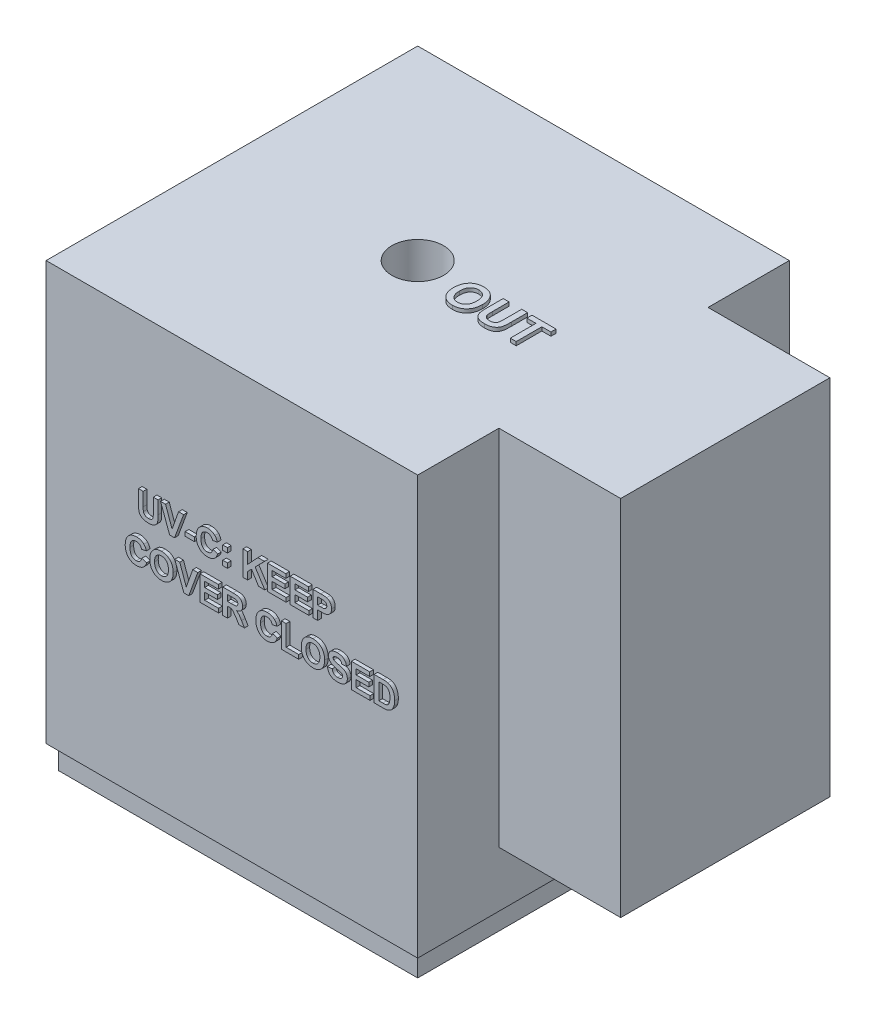
from build123d import *

# Parameters (mm, degrees)
COVER_SHELL_START      = 60
SKETCH1_W              = 60.4
SKETCH1_H              = 60.4
COVER_SHELL_DEPTH      = 68
INNER_CAVITY_START     = 60
SKETCH2_W              = 54.4
SKETCH2_H              = 54.4
INNER_CAVITY_DEPTH     = 60
STEPPED_LIP_START      = 60
SKETCH3_W              = 58.4
SKETCH3_H              = 58.4
SKETCH3_W_2            = 54.4
SKETCH3_H_2            = 54.4
STEPPED_LIP_DEPTH      = 3.8
MAGNET_EAR_START       = 69
SKETCH4_W              = 19.8
SKETCH4_H              = 34
MAGNET_EAR_DEPTH       = 59
MAGNET_POCKET_START    = 69
SKETCH5_W              = 14.4
SKETCH5_H              = 27.4
MAGNET_POCKET_DEPTH    = 8.2
OUTLET_TUBE_HOLE_START = 118
SKETCH6_R              = 4.2
OUTLET_TUBE_HOLE_DEPTH = 10
LABEL_OUT_START        = 128
LABEL_OUT_DEPTH        = 0.6
LABEL_UVC_1_START      = 30.2
SKETCH8_W              = 1.487179487
SKETCH8_H              = 0.666666667
SKETCH8_W_2            = 0.769230769
SKETCH8_H_2            = 0.769230769
LABEL_UVC_1_DEPTH      = 0.6
LABEL_UVC_2_START      = 30.2
LABEL_UVC_2_DEPTH      = 0.6


with BuildPart() as part:
    # Sketch1 → Cover_Shell (new body)
    with BuildSketch(Plane(origin=(0, 0, 0), x_dir=(1, 0, 0), z_dir=(0, 1, 0)).offset(COVER_SHELL_START)):
        with Locations((14, 0)):
            Rectangle(SKETCH1_W, SKETCH1_H)
    extrude(amount=COVER_SHELL_DEPTH)

    # Sketch2 → Inner_Cavity (cut)
    with BuildSketch(Plane(origin=(0, 0, 0), x_dir=(1, 0, 0), z_dir=(0, 1, 0)).offset(INNER_CAVITY_START)):
        with Locations((14, 0)):
            Rectangle(SKETCH2_W, SKETCH2_H)
    extrude(amount=INNER_CAVITY_DEPTH, mode=Mode.SUBTRACT)

    # Sketch3 → Stepped_Lip (add)
    with BuildSketch(Plane(origin=(0, 0, 0), x_dir=(1, 0, 0), z_dir=(0, 1, 0)).offset(STEPPED_LIP_START)):
        with Locations((14, 0)):
            Rectangle(SKETCH3_W, SKETCH3_H)
        with Locations((14, 0)):
            Rectangle(SKETCH3_W_2, SKETCH3_H_2, mode=Mode.SUBTRACT)
    extrude(amount=-STEPPED_LIP_DEPTH)

    # Sketch4 → Magnet_Ear (add)
    with BuildSketch(Plane(origin=(0, 0, 0), x_dir=(1, 0, 0), z_dir=(0, 1, 0)).offset(MAGNET_EAR_START)):
        with Locations((54.1, 0)):
            Rectangle(SKETCH4_W, SKETCH4_H)
    extrude(amount=MAGNET_EAR_DEPTH)

    # Sketch5 → Magnet_Pocket (cut)
    with BuildSketch(Plane(origin=(0, 0, 0), x_dir=(1, 0, 0), z_dir=(0, 1, 0)).offset(MAGNET_POCKET_START)):
        with Locations((53.5, 0)):
            Rectangle(SKETCH5_W, SKETCH5_H)
    extrude(amount=MAGNET_POCKET_DEPTH, mode=Mode.SUBTRACT)

    # Sketch6 → Outlet_Tube_Hole (cut)
    with BuildSketch(Plane(origin=(0, 0, 0), x_dir=(1, 0, 0), z_dir=(0, 1, 0)).offset(OUTLET_TUBE_HOLE_START)):
        with Locations(Location((14, 0, 0), (0, 0, 270))):
            Circle(SKETCH6_R)
    extrude(amount=OUTLET_TUBE_HOLE_DEPTH, mode=Mode.SUBTRACT)

    # Sketch7 → Label_OUT (add)
    # profile 1 of 3: a face of its own
    with BuildSketch(Plane(origin=(0, 0, 0), x_dir=(1, 0, 0), z_dir=(0, 1, 0)).offset(LABEL_OUT_START)):
        with BuildLine():
            add(Edge.make_bspline(
                [(21.320512821, -1.530048077), (21.32086665, -1.46826014), (21.321561526, -1.346916609), (21.333602107, -1.168901093), (21.349472532, -0.998266574), (21.375317493, -0.835684221), (21.405720603, -0.680393092), (21.443746825, -0.532439283), (21.489554956, -0.392341665), (21.525995687, -0.302890849), (21.543870192, -0.259014423)],
                knots=[0, 0, 0, 0, 1.141009212, 2.240794809, 3.294380675, 4.305229195, 5.280013876, 6.216333343, 7.125095522, 8, 8, 8, 8], degree=3))
            add(Edge.make_bspline(
                [(21.543870192, -0.259014423), (21.573088225, -0.196639001), (21.631180637, -0.072621793), (21.739067378, 0.102624492), (21.861350638, 0.267895937), (21.997023692, 0.422326123), (22.142622764, 0.563590189), (22.298834724, 0.684491889), (22.460109828, 0.789114331), (22.574813041, 0.841733201), (22.631610577, 0.867788462)],
                knots=[0, 0, 0, 0, 1.031372299, 2.050613973, 3.077158538, 4.108712802, 5.127684358, 6.111366908, 7.06480644, 8, 8, 8, 8], degree=3))
            add(Edge.make_bspline(
                [(22.631610577, 0.867788462), (22.670164532, 0.883602433), (22.748091904, 0.915566503), (22.869200214, 0.955459336), (22.994903716, 0.987870461), (23.124293204, 1.016842229), (23.258624942, 1.036819217), (23.396813474, 1.053569235), (23.539615058, 1.06234821), (23.63620786, 1.063511419), (23.685296474, 1.064102564)],
                knots=[0, 0, 0, 0, 0.92659354, 1.872881803, 2.832850937, 3.813025581, 4.820167273, 5.851730198, 6.908245912, 8, 8, 8, 8], degree=3))
            add(Edge.make_bspline(
                [(23.685296474, 1.064102564), (23.773193439, 1.061899276), (23.945209007, 1.05758741), (24.196475447, 1.026443319), (24.43424979, 0.973853653), (24.657727165, 0.897842094), (24.868834326, 0.802825995), (25.065931095, 0.684969344), (25.24930918, 0.545547711), (25.418614395, 0.386473013), (25.571085868, 0.208022478), (25.703875854, 0.011863101), (25.8152687, -0.201085899), (25.90700714, -0.430236984), (25.977501218, -0.676338635), (26.028433124, -0.938696452), (26.058690799, -1.217503681), (26.062266286, -1.408777791), (26.064102564, -1.507011218)],
                knots=[0, 0, 0, 0, 1.064641025, 2.083517118, 3.061799897, 4.009540929, 4.938075217, 5.861300345, 6.78508344, 7.723570974, 8.670267188, 9.622657076, 10.586935816, 11.576069104, 12.607749008, 13.683335114, 14.81022093, 16, 16, 16, 16], degree=3))
            add(Edge.make_bspline(
                [(26.064102564, -1.507011218), (26.062308699, -1.604586861), (26.058816379, -1.794548407), (26.027993925, -2.071167824), (25.979173581, -2.331613045), (25.906973827, -2.575289116), (25.817973394, -2.804055451), (25.705434288, -3.015187258), (25.575425325, -3.211485063), (25.42317041, -3.388012653), (25.256714698, -3.548000281), (25.073569219, -3.685792426), (24.877907217, -3.803808767), (24.667951052, -3.899099447), (24.445069179, -3.973545576), (24.208534239, -4.026539354), (23.958224918, -4.057563599), (23.786879576, -4.06189112), (23.69931891, -4.064102564)],
                knots=[0, 0, 0, 0, 1.18845052, 2.313691126, 3.386664782, 4.412527756, 5.405809582, 6.372003093, 7.321919452, 8.268293321, 9.206237639, 10.129603466, 11.054616372, 11.9847576, 12.932764752, 13.912672021, 14.933336461, 16, 16, 16, 16], degree=3))
            add(Edge.make_bspline(
                [(23.69931891, -4.064102564), (23.610758072, -4.061886017), (23.437419069, -4.057547597), (23.184439965, -4.026617788), (22.945557013, -3.973606565), (22.720940318, -3.898898572), (22.509057952, -3.805055472), (22.311866145, -3.688245088), (22.129255894, -3.549580281), (21.961409347, -3.391475847), (21.809248577, -3.215467251), (21.679424209, -3.020431586), (21.566879234, -2.811362009), (21.477410881, -2.585091616), (21.405608705, -2.34394844), (21.356669064, -2.086544922), (21.32578701, -1.813589506), (21.322303018, -1.626289413), (21.320512821, -1.530048077)],
                knots=[0, 0, 0, 0, 1.080878253, 2.11558926, 3.1052859, 4.062802436, 5.000434901, 5.928596448, 6.853693179, 7.793554778, 8.738606028, 9.68692032, 10.647726704, 11.63151566, 12.651483354, 13.714466703, 14.825613081, 16, 16, 16, 16], degree=3))
        make_face()
        with BuildLine():
            add(Edge.make_bspline(
                [(22.282051282, -1.496995192), (22.283011847, -1.566158402), (22.284871963, -1.700091641), (22.304684657, -1.894492497), (22.334752015, -2.076230033), (22.378970481, -2.245097982), (22.434832097, -2.401218507), (22.503274157, -2.544722202), (22.584013816, -2.675822801), (22.679139412, -2.791752585), (22.782057847, -2.895255536), (22.893149116, -2.984811692), (23.010342869, -3.061893222), (23.135666912, -3.122748828), (23.266513029, -3.171044411), (23.403897803, -3.206853816), (23.548504343, -3.226516696), (23.647179832, -3.229336514), (23.697315705, -3.230769231)],
                knots=[0, 0, 0, 0, 1.313550922, 2.543666373, 3.708465049, 4.810029406, 5.85539231, 6.85404609, 7.825601258, 8.772642133, 9.696587791, 10.59409323, 11.479048685, 12.35559886, 13.234601248, 14.125357077, 15.047515647, 16, 16, 16, 16], degree=3))
            add(Edge.make_bspline(
                [(23.697315705, -3.230769231), (23.747458332, -3.229365543), (23.846147114, -3.226602859), (23.990575977, -3.206537945), (24.128233011, -3.172263406), (24.258559315, -3.124215311), (24.382148899, -3.062393391), (24.498894115, -2.987039868), (24.608122015, -2.89707627), (24.710928425, -2.795076958), (24.803486352, -2.678377181), (24.883538579, -2.547299206), (24.951946918, -2.402925157), (25.007814416, -2.245201023), (25.050944657, -2.073830049), (25.079784892, -1.88872156), (25.099757801, -1.690404841), (25.10161033, -1.553472296), (25.102564103, -1.482972756)],
                knots=[0, 0, 0, 0, 0.949153107, 1.868086493, 2.754172764, 3.630100905, 4.492260106, 5.365378617, 6.254840125, 7.166615376, 8.102436631, 9.067266169, 10.06813181, 11.121736829, 12.23011542, 13.408501285, 14.665770308, 16, 16, 16, 16], degree=3))
            add(Edge.make_bspline(
                [(25.102564103, -1.482972756), (25.101486805, -1.413153927), (25.099400515, -1.27794313), (25.081231087, -1.082129973), (25.051472922, -0.899955863), (25.010105784, -0.731467995), (24.955436512, -0.576639218), (24.890140464, -0.435046138), (24.811188268, -0.307428501), (24.720639774, -0.193852384), (24.620443695, -0.093883504), (24.51230233, -0.006365033), (24.395601257, 0.066455656), (24.27147946, 0.127724386), (24.138644701, 0.173179434), (23.998446894, 0.206333962), (23.850489287, 0.226750572), (23.749130932, 0.229409808), (23.697315705, 0.230769231)],
                knots=[0, 0, 0, 0, 1.332337092, 2.580197383, 3.749299508, 4.852775005, 5.886662144, 6.878700295, 7.822989687, 8.743523536, 9.644687758, 10.519443927, 11.392806431, 12.264866173, 13.155606721, 14.065961015, 15.011303331, 16, 16, 16, 16], degree=3))
            add(Edge.make_bspline(
                [(23.697315705, 0.230769231), (23.645493929, 0.229430718), (23.544122763, 0.226812387), (23.395934524, 0.206057751), (23.255295048, 0.173891143), (23.122479065, 0.125840607), (22.997276127, 0.065160251), (22.880149328, -0.010095485), (22.770175743, -0.097465431), (22.669081936, -0.198950068), (22.577066271, -0.313520756), (22.498076054, -0.442697751), (22.43071954, -0.58507028), (22.375457425, -0.741059777), (22.334491109, -0.91109536), (22.303005086, -1.094034287), (22.285323702, -1.290983812), (22.283165533, -1.42684882), (22.282051282, -1.496995192)],
                knots=[0, 0, 0, 0, 0.981996942, 1.920933313, 2.83127778, 3.712125466, 4.592427284, 5.463259035, 6.34592384, 7.249932058, 8.173122297, 9.125107726, 10.113123258, 11.154048744, 12.256187849, 13.424658091, 14.670364834, 16, 16, 16, 16], degree=3))
        make_face(mode=Mode.SUBTRACT)
    # profile 2 of 3: a face of its own
    with BuildSketch(Plane(origin=(0, 0, 0), x_dir=(1, 0, 0), z_dir=(0, 1, 0)).offset(LABEL_OUT_START)):
        with BuildLine():
            Line((26.897435897, 1), (27.858974359, 1))
            Line((27.858974359, 1), (27.858974359, -1.713341346))
            add(Edge.make_bspline(
                [(27.858974359, -1.713341346), (27.859341439, -1.764756887), (27.860042229, -1.862914037), (27.860524622, -2.003150372), (27.863194245, -2.129060911), (27.868983583, -2.24084854), (27.872956966, -2.338456248), (27.880335107, -2.42190195), (27.887695366, -2.491153149), (27.894851306, -2.532344335), (27.898036859, -2.55068109)],
                knots=[0, 0, 0, 0, 1.470600056, 2.807515117, 4.011048972, 5.072079398, 6.00911328, 6.804506435, 7.467811572, 8, 8, 8, 8], degree=3))
            add(Edge.make_bspline(
                [(27.898036859, -2.55068109), (27.911170105, -2.600114301), (27.937031124, -2.697454535), (28.008313604, -2.830516051), (28.102476752, -2.947801398), (28.198526636, -3.03144473), (28.285411154, -3.090641274), (28.359212434, -3.126669144), (28.437515109, -3.159510864), (28.52197454, -3.184710038), (28.611684259, -3.206760222), (28.707727862, -3.219509793), (28.809294799, -3.229294771), (28.878912466, -3.230268955), (28.914663462, -3.230769231)],
                knots=[0, 0, 0, 0, 1.376921055, 2.711331395, 4.038631339, 5.418057255, 6.132954575, 6.870556231, 7.630397752, 8.422890386, 9.247036838, 10.121396817, 11.035274583, 12, 12, 12, 12], degree=3))
            add(Edge.make_bspline(
                [(28.914663462, -3.230769231), (28.950732307, -3.230115055), (29.020957612, -3.228841387), (29.122726069, -3.221256253), (29.217674298, -3.20694572), (29.305744218, -3.188181847), (29.387400983, -3.164467456), (29.461993147, -3.13444225), (29.529403164, -3.098309636), (29.608608917, -3.043848859), (29.693834205, -2.967022425), (29.775852663, -2.862567075), (29.834552632, -2.747259731), (29.862085405, -2.641975501), (29.876236326, -2.550244585), (29.884857828, -2.469976847), (29.892742628, -2.37914162), (29.899902628, -2.277987699), (29.904799151, -2.166439157), (29.907447594, -2.044213879), (29.909531933, -1.911331359), (29.910009161, -1.819178251), (29.91025641, -1.771434295)],
                knots=[0, 0, 0, 0, 1.036876239, 2.018776863, 2.930845756, 3.794842666, 4.605604932, 5.371924355, 6.101864688, 6.799283669, 8.1310906, 9.382718023, 10.597336334, 11.822035891, 12.492591141, 13.265194674, 14.141890321, 15.11351293, 16.179860579, 17.351049011, 18.627594861, 20, 20, 20, 20], degree=3))
            Line((29.91025641, -1.771434295), (29.91025641, 1))
            Line((29.91025641, 1), (30.871794872, 1))
            Line((30.871794872, 1), (30.871794872, -1.615184295))
            add(Edge.make_bspline(
                [(30.871794872, -1.615184295), (30.871671629, -1.687300401), (30.871434823, -1.825869518), (30.867737413, -2.025235904), (30.859879246, -2.208146206), (30.853298709, -2.374913958), (30.840605123, -2.525113719), (30.827314982, -2.658838878), (30.810194254, -2.776066064), (30.785779937, -2.909311796), (30.744750089, -3.058804935), (30.678624081, -3.223939278), (30.594113056, -3.374176182), (30.491553773, -3.510092091), (30.371537055, -3.632227205), (30.232265906, -3.740101371), (30.075172446, -3.835026035), (29.931214433, -3.903377724), (29.805701489, -3.949403512), (29.703473295, -3.980551703), (29.594065687, -4.006491629), (29.47760698, -4.027077268), (29.354047135, -4.044434007), (29.223341287, -4.056025464), (29.085687185, -4.063259351), (28.991796444, -4.063816975), (28.943709936, -4.064102564)],
                knots=[0, 0, 0, 0, 1.415574045, 2.719986624, 3.913607924, 5.00929969, 5.995467356, 6.871900228, 7.64671288, 8.320227872, 9.530145585, 10.682614022, 11.803571353, 12.90325401, 14.015460715, 15.154679255, 16.351678057, 17.612271512, 18.275764165, 18.974412946, 19.708786676, 20.481351116, 21.295095879, 22.157200529, 23.056203067, 24, 24, 24, 24], degree=3))
            add(Edge.make_bspline(
                [(28.943709936, -4.064102564), (28.885946807, -4.063364201), (28.774051016, -4.061933882), (28.611624972, -4.055553352), (28.460285233, -4.042383694), (28.319556318, -4.024583668), (28.18949633, -4.001701152), (28.069776249, -3.974345247), (27.961351864, -3.939771244), (27.832209721, -3.890391208), (27.68825926, -3.814856308), (27.531563092, -3.714093365), (27.394010804, -3.600364493), (27.276810999, -3.474780967), (27.178836523, -3.341756075), (27.099200585, -3.204168331), (27.035382965, -3.064311008), (27.008716341, -2.967107432), (26.995592949, -2.919270833)],
                knots=[0, 0, 0, 0, 1.128613534, 2.186292659, 3.174878439, 4.095586888, 4.95671962, 5.754129884, 6.492676435, 7.178284149, 8.453103036, 9.659838108, 10.813193309, 11.929983019, 13.007587775, 14.033493319, 15.032227051, 16, 16, 16, 16], degree=3))
            add(Edge.make_bspline(
                [(26.995592949, -2.919270833), (26.987560971, -2.881609607), (26.970643056, -2.802283022), (26.951429002, -2.676169302), (26.933900122, -2.537296974), (26.921927669, -2.385501776), (26.91057888, -2.221265327), (26.902430851, -2.044277957), (26.899080374, -1.854579855), (26.897995099, -1.723691784), (26.897435897, -1.65625)],
                knots=[0, 0, 0, 0, 0.728071598, 1.533551606, 2.411422299, 3.374601532, 4.412367648, 5.524718474, 6.72457895, 8, 8, 8, 8], degree=3))
            Line((26.897435897, -1.65625), (26.897435897, 1))
        make_face()
    # profile 3 of 3: a face of its own
    with BuildSketch(Plane(origin=(0, 0, 0), x_dir=(1, 0, 0), z_dir=(0, 1, 0)).offset(LABEL_OUT_START)):
        Polygon((33.051282051, -4), (33.051282051, 0.166666667), (31.576923077, 0.166666667), (31.576923077, 1), (35.487179487, 1), (35.487179487, 0.166666667), (34.012820513, 0.166666667), (34.012820513, -4), align=None)
    extrude(amount=LABEL_OUT_DEPTH)

    # Sketch8 → Label_UVC_1 (add)
    # profile 1 of 10: a face of its own
    with BuildSketch(Plane.XY.offset(LABEL_UVC_1_START)):
        with BuildLine():
            Line((-0.58974359, 104), (0.179487179, 104))
            Line((0.179487179, 104), (0.179487179, 101.829326923))
            add(Edge.make_bspline(
                [(0.179487179, 101.829326923), (0.179780843, 101.78819449), (0.180341476, 101.70966877), (0.18072739, 101.597479702), (0.182863088, 101.496751271), (0.187494559, 101.407321168), (0.190673265, 101.329235002), (0.196575778, 101.26247844), (0.202463985, 101.207077481), (0.208188737, 101.174124532), (0.210737179, 101.159455128)],
                knots=[0, 0, 0, 0, 1.470600056, 2.807515117, 4.011048972, 5.072079398, 6.00911328, 6.804506435, 7.467811572, 8, 8, 8, 8], degree=3))
            add(Edge.make_bspline(
                [(0.210737179, 101.159455128), (0.221243776, 101.119908559), (0.241932592, 101.042036372), (0.298958575, 100.935587159), (0.374289094, 100.841758881), (0.451129001, 100.774844216), (0.520636616, 100.727486981), (0.579677639, 100.698664685), (0.64231978, 100.672391309), (0.709887325, 100.652231969), (0.781655099, 100.634591822), (0.858489982, 100.624392166), (0.939743531, 100.616564183), (0.995437665, 100.615784836), (1.024038462, 100.615384615)],
                knots=[0, 0, 0, 0, 1.376921055, 2.711331395, 4.038631339, 5.418057255, 6.132954575, 6.870556231, 7.630397752, 8.422890386, 9.247036838, 10.121396817, 11.035274583, 12, 12, 12, 12], degree=3))
            add(Edge.make_bspline(
                [(1.024038462, 100.615384615), (1.052893538, 100.615907956), (1.109073782, 100.61692689), (1.190488547, 100.622994998), (1.266447131, 100.634443424), (1.336903067, 100.649454523), (1.402228479, 100.668426035), (1.46190221, 100.6924462), (1.515830223, 100.721352291), (1.579194826, 100.764920913), (1.647375056, 100.82638206), (1.712989822, 100.90994634), (1.759949798, 101.002192215), (1.781976017, 101.086419599), (1.793296753, 101.159804332), (1.800193955, 101.224018522), (1.806501794, 101.296686704), (1.812229795, 101.377609841), (1.816147013, 101.466848675), (1.818265768, 101.564628897), (1.819933239, 101.670934913), (1.820315021, 101.744657399), (1.820512821, 101.782852564)],
                knots=[0, 0, 0, 0, 1.036876239, 2.018776863, 2.930845756, 3.794842666, 4.605604932, 5.371924355, 6.101864688, 6.799283669, 8.1310906, 9.382718023, 10.597336334, 11.822035891, 12.492591141, 13.265194674, 14.141890321, 15.11351293, 16.179860579, 17.351049011, 18.627594861, 20, 20, 20, 20], degree=3))
            Line((1.820512821, 101.782852564), (1.820512821, 104))
            Line((1.820512821, 104), (2.58974359, 104))
            Line((2.58974359, 104), (2.58974359, 101.907852564))
            add(Edge.make_bspline(
                [(2.58974359, 101.907852564), (2.589644996, 101.850159679), (2.58945555, 101.739304386), (2.586497623, 101.579811277), (2.580211089, 101.433483036), (2.574946659, 101.300068834), (2.564791791, 101.179909024), (2.554159678, 101.072928897), (2.540463095, 100.979147149), (2.520931642, 100.872550563), (2.488107763, 100.752956052), (2.435206957, 100.620848577), (2.367598137, 100.500659054), (2.28555071, 100.391926327), (2.189537336, 100.294218236), (2.078120417, 100.207918903), (1.952445649, 100.131979172), (1.837279239, 100.07729782), (1.736868883, 100.04047719), (1.655086328, 100.015558638), (1.567560242, 99.994806697), (1.474393277, 99.978338186), (1.3755454, 99.964452795), (1.270980722, 99.955179629), (1.16085744, 99.949392519), (1.085744848, 99.94894642), (1.047275641, 99.948717949)],
                knots=[0, 0, 0, 0, 1.415574045, 2.719986624, 3.913607924, 5.00929969, 5.995467356, 6.871900228, 7.64671288, 8.320227872, 9.530145585, 10.682614022, 11.803571353, 12.90325401, 14.015460715, 15.154679255, 16.351678057, 17.612271512, 18.275764165, 18.974412946, 19.708786676, 20.481351116, 21.295095879, 22.157200529, 23.056203067, 24, 24, 24, 24], degree=3))
            add(Edge.make_bspline(
                [(1.047275641, 99.948717949), (1.001065138, 99.949308639), (0.911548505, 99.950452894), (0.78160767, 99.955557318), (0.660535879, 99.966093045), (0.547952747, 99.980333066), (0.443904757, 99.998639079), (0.348128692, 100.020523802), (0.261389184, 100.048183005), (0.158075469, 100.087687033), (0.0429151, 100.148114954), (-0.082441834, 100.228725308), (-0.192483665, 100.319708405), (-0.286243509, 100.420175227), (-0.364623089, 100.52659514), (-0.42833184, 100.636665335), (-0.479385936, 100.748551193), (-0.500719235, 100.826314054), (-0.511217949, 100.864583333)],
                knots=[0, 0, 0, 0, 1.128613534, 2.186292659, 3.174878439, 4.095586888, 4.95671962, 5.754129884, 6.492676435, 7.178284149, 8.453103036, 9.659838108, 10.813193309, 11.929983019, 13.007587775, 14.033493319, 15.032227051, 16, 16, 16, 16], degree=3))
            add(Edge.make_bspline(
                [(-0.511217949, 100.864583333), (-0.517643531, 100.894712314), (-0.531177863, 100.958173583), (-0.546549106, 101.059064559), (-0.56057221, 101.170162421), (-0.570150172, 101.291598579), (-0.579229204, 101.422987739), (-0.585747627, 101.564577635), (-0.588428009, 101.716336116), (-0.589296228, 101.821046573), (-0.58974359, 101.875)],
                knots=[0, 0, 0, 0, 0.728071598, 1.533551606, 2.411422299, 3.374601532, 4.412367648, 5.524718474, 6.72457895, 8, 8, 8, 8], degree=3))
            Line((-0.58974359, 101.875), (-0.58974359, 104))
        make_face()
    # profile 2 of 10: a face of its own
    with BuildSketch(Plane.XY.offset(LABEL_UVC_1_START)):
        Polygon((4.479166667, 100), (3, 104), (3.8125, 104), (4.871794872, 101.025641026), (5.926282051, 104), (6.743589744, 104), (5.270833333, 100), align=None)
    # profile 3 of 10: a face of its own
    with BuildSketch(Plane.XY.offset(LABEL_UVC_1_START)):
        with Locations((7.743589744, 101.410256411)):
            Rectangle(SKETCH8_W, SKETCH8_H)
    # profile 4 of 10: a face of its own
    with BuildSketch(Plane.XY.offset(LABEL_UVC_1_START)):
        with BuildLine():
            Line((11.512820513, 101.487179487), (12.282051282, 101.230769231))
            add(Edge.make_bspline(
                [(12.282051282, 101.230769231), (12.266418145, 101.180332707), (12.235803545, 101.081562127), (12.179590008, 100.940000434), (12.1153107, 100.808808759), (12.045277247, 100.68645159), (11.965134407, 100.576089811), (11.879369002, 100.474069408), (11.785430883, 100.382539125), (11.683783569, 100.301303513), (11.575405471, 100.229465094), (11.459037661, 100.168733578), (11.336416765, 100.116427097), (11.206299338, 100.074047819), (11.069548926, 100.040108451), (10.925523887, 100.017691314), (10.774897956, 100.002491754), (10.672048406, 100.000843752), (10.619391026, 100)],
                knots=[0, 0, 0, 0, 1.126640671, 2.206316847, 3.246446654, 4.24268115, 5.210795778, 6.153057602, 7.084219323, 8.004711971, 8.926421631, 9.854560063, 10.802134612, 11.768317461, 12.772025444, 13.805668576, 14.876536225, 16, 16, 16, 16], degree=3))
            add(Edge.make_bspline(
                [(10.619391026, 100), (10.55439625, 100.001343951), (10.426549583, 100.003987543), (10.239585941, 100.030598944), (10.061418044, 100.072119076), (9.891791012, 100.129602977), (9.731837081, 100.205740257), (9.580096927, 100.297399672), (9.437674859, 100.406442057), (9.305070518, 100.531029627), (9.184596268, 100.670211291), (9.080417208, 100.823234951), (8.991399804, 100.987944876), (8.919451348, 101.165126422), (8.863192511, 101.354597653), (8.823783079, 101.556096597), (8.799123162, 101.769686724), (8.796313677, 101.916062825), (8.794871795, 101.991185897)],
                knots=[0, 0, 0, 0, 1.025049111, 2.016302254, 2.973197159, 3.90886983, 4.83646737, 5.763135642, 6.70136783, 7.661478232, 8.629732022, 9.600038443, 10.576877021, 11.5787097, 12.612181225, 13.690866959, 14.814907849, 16, 16, 16, 16], degree=3))
            add(Edge.make_bspline(
                [(8.794871795, 101.991185897), (8.796307178, 102.070314328), (8.799107349, 102.224679457), (8.823813463, 102.44911314), (8.862168233, 102.660628802), (8.918522156, 102.857914963), (8.989413318, 103.042360053), (9.078538798, 103.212133102), (9.181678675, 103.369497646), (9.301606155, 103.511569389), (9.434814824, 103.637709886), (9.577564389, 103.749252186), (9.731186575, 103.842828179), (9.894840726, 103.919349729), (10.068746333, 103.978565871), (10.252561195, 104.021206141), (10.446435706, 104.04602552), (10.578988671, 104.049505903), (10.646634615, 104.051282051)],
                knots=[0, 0, 0, 0, 1.212648312, 2.365655595, 3.457000981, 4.504219827, 5.506356588, 6.480637568, 7.437950897, 8.385265166, 9.323599949, 10.245787653, 11.157260172, 12.074946661, 13.00980897, 13.968233668, 14.963125779, 16, 16, 16, 16], degree=3))
            add(Edge.make_bspline(
                [(10.646634615, 104.051282051), (10.705712433, 104.049793443), (10.821542356, 104.04687483), (10.991163516, 104.027045661), (11.151916907, 103.992246794), (11.304671453, 103.945276061), (11.448557592, 103.883287189), (11.583833094, 103.807537426), (11.710962934, 103.718427566), (11.78756128, 103.648822211), (11.826121795, 103.613782051)],
                knots=[0, 0, 0, 0, 1.098510076, 2.153775193, 3.169777012, 4.153122333, 5.120892526, 6.076995459, 7.031936742, 8, 8, 8, 8], degree=3))
            add(Edge.make_bspline(
                [(11.826121795, 103.613782051), (11.848470963, 103.591485642), (11.893694265, 103.546369096), (11.954080066, 103.470199583), (12.011333307, 103.38820309), (12.064545265, 103.29898086), (12.112034144, 103.201858642), (12.156085151, 103.098327922), (12.196641261, 102.987989626), (12.219195121, 102.911200989), (12.230769231, 102.871794872)],
                knots=[0, 0, 0, 0, 0.885292881, 1.791380647, 2.722937556, 3.69093542, 4.703306561, 5.754477758, 6.847650944, 8, 8, 8, 8], degree=3))
            Line((12.230769231, 102.871794872), (11.461538462, 102.717948718))
            add(Edge.make_bspline(
                [(11.461538462, 102.717948718), (11.455000316, 102.743179532), (11.442121885, 102.792877615), (11.416064133, 102.864291032), (11.386173836, 102.932055987), (11.349127551, 102.994512679), (11.309774816, 103.054439631), (11.263183399, 103.1091759), (11.212328791, 103.160156003), (11.156844644, 103.206850892), (11.097392407, 103.248317024), (11.035116748, 103.285592493), (10.968885781, 103.316020924), (10.899580541, 103.340637453), (10.827477064, 103.361276558), (10.751933409, 103.374026295), (10.673598408, 103.383813973), (10.620225996, 103.384344332), (10.592948718, 103.384615385)],
                knots=[0, 0, 0, 0, 1.051226935, 2.070641259, 3.064374968, 4.034983734, 4.997599858, 5.953980297, 6.92954377, 7.901109626, 8.875958313, 9.851998019, 10.826131395, 11.811470594, 12.818270757, 13.847890818, 14.900111925, 16, 16, 16, 16], degree=3))
            add(Edge.make_bspline(
                [(10.592948718, 103.384615385), (10.555488436, 103.383858858), (10.482377174, 103.382382343), (10.375513863, 103.365920209), (10.273660983, 103.342945596), (10.177229299, 103.307863482), (10.086815988, 103.262993748), (10.001393498, 103.20844957), (9.921430672, 103.144464572), (9.846900485, 103.070280743), (9.780019773, 102.984556804), (9.72122208, 102.887115764), (9.672444123, 102.776851355), (9.632844179, 102.654845615), (9.601674512, 102.520808414), (9.579416916, 102.374567842), (9.567107796, 102.216023857), (9.565125924, 102.106324103), (9.564102564, 102.049679487)],
                knots=[0, 0, 0, 0, 0.938194206, 1.831074359, 2.704771284, 3.551924377, 4.396294915, 5.230222094, 6.087631332, 6.958733431, 7.860107878, 8.806247581, 9.804197948, 10.875520245, 12.017191412, 13.250061517, 14.580040491, 16, 16, 16, 16], degree=3))
            add(Edge.make_bspline(
                [(9.564102564, 102.049679487), (9.565115848, 101.98956389), (9.567068289, 101.873730394), (9.579374797, 101.706651289), (9.60177472, 101.552982713), (9.632530143, 101.412451958), (9.672329646, 101.285145101), (9.721025114, 101.171282443), (9.778914733, 101.07073064), (9.845908438, 100.983556646), (9.920312514, 100.908674453), (10.000111782, 100.844292817), (10.084835444, 100.789246772), (10.174993328, 100.743958435), (10.270928347, 100.709698313), (10.371852056, 100.684852271), (10.47813476, 100.669057247), (10.550958342, 100.667474695), (10.588141026, 100.666666667)],
                knots=[0, 0, 0, 0, 1.475208372, 2.842499301, 4.107722225, 5.282836115, 6.369007568, 7.375918121, 8.315702116, 9.208439171, 10.065831443, 10.90006451, 11.71996243, 12.54067204, 13.369972975, 14.214060185, 15.088124569, 16, 16, 16, 16], degree=3))
            add(Edge.make_bspline(
                [(10.588141026, 100.666666667), (10.615669728, 100.667353464), (10.669800835, 100.66870395), (10.749810784, 100.677275378), (10.826604017, 100.693632714), (10.900556414, 100.71526233), (10.971955303, 100.742401116), (11.039711617, 100.777214723), (11.105158432, 100.817227793), (11.166937778, 100.864120046), (11.225876914, 100.916765552), (11.279632902, 100.977610637), (11.329496045, 101.04519333), (11.374833751, 101.119965289), (11.4171609, 101.201286492), (11.453173053, 101.290423966), (11.486721602, 101.38593721), (11.503968926, 101.45284262), (11.512820513, 101.487179487)],
                knots=[0, 0, 0, 0, 0.980177776, 1.927374078, 2.859849964, 3.771585772, 4.668674471, 5.574490016, 6.479656464, 7.396337719, 8.332153134, 9.288470092, 10.28125149, 11.318486971, 12.398724812, 13.541284404, 14.738150009, 16, 16, 16, 16], degree=3))
        make_face()
    # profile 5 of 10: a face of its own
    with BuildSketch(Plane.XY.offset(LABEL_UVC_1_START)):
        with Locations((13.487179488, 102.538461539)):
            Rectangle(SKETCH8_W_2, SKETCH8_H_2)
    # profile 6 of 10: a face of its own
    with BuildSketch(Plane.XY.offset(LABEL_UVC_1_START)):
        with Locations((13.487179488, 100.384615384)):
            Rectangle(SKETCH8_W_2, SKETCH8_H_2)
    # profile 7 of 10: a face of its own
    with BuildSketch(Plane.XY.offset(LABEL_UVC_1_START)):
        Polygon((16.384615385, 100), (16.384615385, 104), (17.153846154, 104), (17.153846154, 102.209134615), (18.840544872, 104), (19.897435897, 104), (18.378205128, 102.453525641), (19.948717949, 100), (18.923878205, 100), (17.794871795, 101.858173077), (17.153846154, 101.205929487), (17.153846154, 100), align=None)
    # profile 8 of 10: a face of its own
    with BuildSketch(Plane.XY.offset(LABEL_UVC_1_START)):
        Polygon((20.384615385, 100), (20.384615385, 104), (23.358974359, 104), (23.358974359, 103.333333333), (21.153846154, 103.333333333), (21.153846154, 102.461538462), (23.205128205, 102.461538462), (23.205128205, 101.794871795), (21.153846154, 101.794871795), (21.153846154, 100.666666667), (23.41025641, 100.666666667), (23.41025641, 100), align=None)
    # profile 9 of 10: a face of its own
    with BuildSketch(Plane.XY.offset(LABEL_UVC_1_START)):
        Polygon((24.076923077, 100), (24.076923077, 104), (27.051282051, 104), (27.051282051, 103.333333333), (24.846153846, 103.333333333), (24.846153846, 102.461538462), (26.897435897, 102.461538462), (26.897435897, 101.794871795), (24.846153846, 101.794871795), (24.846153846, 100.666666667), (27.102564103, 100.666666667), (27.102564103, 100), align=None)
    # profile 10 of 10: a face of its own
    with BuildSketch(Plane.XY.offset(LABEL_UVC_1_START)):
        with BuildLine():
            Line((27.769230769, 100), (27.769230769, 104))
            Line((27.769230769, 104), (29.048878205, 104))
            add(Edge.make_bspline(
                [(29.048878205, 104), (29.106839501, 103.999936704), (29.217697371, 103.999815641), (29.375829416, 103.996452031), (29.518203633, 103.99169047), (29.644608713, 103.985760147), (29.755489445, 103.976910965), (29.850348428, 103.966663747), (29.929782985, 103.955640459), (29.976559643, 103.94423283), (29.997596154, 103.939102564)],
                knots=[0, 0, 0, 0, 1.460485487, 2.793352117, 3.985295279, 5.050041172, 5.981765236, 6.787433016, 7.454681457, 8, 8, 8, 8], degree=3))
            add(Edge.make_bspline(
                [(29.997596154, 103.939102564), (30.025569598, 103.931126257), (30.08109033, 103.915295157), (30.160634227, 103.881545765), (30.237301947, 103.842432021), (30.310130244, 103.795815508), (30.379366683, 103.742523834), (30.445217066, 103.6829916), (30.508032566, 103.616950063), (30.566944208, 103.544529687), (30.620900343, 103.466095651), (30.667532, 103.381531993), (30.706599579, 103.291206269), (30.739884506, 103.195797267), (30.764442285, 103.094282048), (30.781628265, 102.987365949), (30.793591851, 102.875002209), (30.79443891, 102.79810963), (30.794871795, 102.758814103)],
                knots=[0, 0, 0, 0, 0.907145743, 1.80047177, 2.69161667, 3.591261238, 4.495029544, 5.415863088, 6.359363025, 7.337192411, 8.326890979, 9.326929023, 10.346104993, 11.395420813, 12.477187422, 13.601053412, 14.774031606, 16, 16, 16, 16], degree=3))
            add(Edge.make_bspline(
                [(30.794871795, 102.758814103), (30.79363721, 102.699139376), (30.791260565, 102.584262252), (30.764670133, 102.41957197), (30.724113183, 102.269138014), (30.664836269, 102.134409376), (30.592565397, 102.014857357), (30.512957544, 101.907081777), (30.422057074, 101.814331101), (30.323847136, 101.735108503), (30.22005718, 101.670276015), (30.116079343, 101.61500724), (30.010510597, 101.572514839), (29.93853406, 101.554000559), (29.903044872, 101.544871795)],
                knots=[0, 0, 0, 0, 1.312386234, 2.526415563, 3.661883817, 4.733421185, 5.753802465, 6.732107337, 7.675884281, 8.604170108, 9.50284679, 10.365392406, 11.194030444, 12, 12, 12, 12], degree=3))
            add(Edge.make_bspline(
                [(29.903044872, 101.544871795), (29.87771443, 101.540053349), (29.82432088, 101.529896641), (29.739641903, 101.519772252), (29.647083193, 101.508565657), (29.546264049, 101.501256086), (29.437306435, 101.494410979), (29.32025266, 101.491179178), (29.195270007, 101.487285515), (29.109245311, 101.48721555), (29.064903846, 101.487179487)],
                knots=[0, 0, 0, 0, 0.735353946, 1.55003838, 2.431865514, 3.394945452, 4.432993119, 5.54609699, 6.735134699, 8, 8, 8, 8], degree=3))
            Line((29.064903846, 101.487179487), (28.538461538, 101.487179487))
            Line((28.538461538, 101.487179487), (28.538461538, 100))
            Line((28.538461538, 100), (27.769230769, 100))
        make_face()
        with BuildLine():
            Line((28.538461538, 103.333333333), (28.538461538, 102.153846154))
            Line((28.538461538, 102.153846154), (29, 102.153846154))
            add(Edge.make_bspline(
                [(29, 102.153846154), (29.039800504, 102.153897692), (29.115943876, 102.153996291), (29.225192724, 102.157535426), (29.324084885, 102.161855596), (29.41282699, 102.169006361), (29.490883369, 102.178430898), (29.558776746, 102.189703832), (29.616586249, 102.201800867), (29.679099357, 102.221847594), (29.745938367, 102.254281369), (29.817314575, 102.300896851), (29.88001849, 102.356631158), (29.932196458, 102.422089171), (29.973875102, 102.494816815), (30.003717042, 102.574068755), (30.022985954, 102.658531508), (30.024745994, 102.717041046), (30.025641026, 102.746794872)],
                knots=[0, 0, 0, 0, 1.411705958, 2.700771114, 3.876961699, 4.922619712, 5.858038221, 6.66485904, 7.363650596, 7.950905807, 8.989198271, 9.987739806, 10.967313358, 11.951275539, 12.944273208, 13.927870418, 14.946261014, 16, 16, 16, 16], degree=3))
            add(Edge.make_bspline(
                [(30.025641026, 102.746794872), (30.024381366, 102.783034566), (30.021939053, 102.853298556), (29.995007155, 102.953366204), (29.953454313, 103.044178808), (29.894045546, 103.122910777), (29.822281154, 103.189117889), (29.741620973, 103.244204559), (29.650342468, 103.282754631), (29.585741752, 103.297691361), (29.552884615, 103.305288462)],
                knots=[0, 0, 0, 0, 1.085904563, 2.105425768, 3.088705091, 4.068969419, 5.045188284, 6.010769642, 6.988240112, 8, 8, 8, 8], degree=3))
            add(Edge.make_bspline(
                [(29.552884615, 103.305288462), (29.538745439, 103.307549908), (29.507360851, 103.312569616), (29.455193279, 103.317808307), (29.393479033, 103.322572891), (29.322143722, 103.326484756), (29.241470102, 103.32954293), (29.151192076, 103.332222643), (29.051547406, 103.332437923), (28.981836954, 103.333026594), (28.945512821, 103.333333333)],
                knots=[0, 0, 0, 0, 0.564603001, 1.253243608, 2.066786758, 3.005752288, 4.070476343, 5.250658742, 6.567396469, 8, 8, 8, 8], degree=3))
            Line((28.945512821, 103.333333333), (28.538461538, 103.333333333))
        make_face(mode=Mode.SUBTRACT)
    extrude(amount=LABEL_UVC_1_DEPTH)

    # Sketch9 → Label_UVC_2 (add)
    # profile 1 of 11: a face of its own
    with BuildSketch(Plane.XY.offset(LABEL_UVC_2_START)):
        with BuildLine():
            Line((-0.025641026, 94.487179487), (0.743589744, 94.230769231))
            add(Edge.make_bspline(
                [(0.743589744, 94.230769231), (0.727956607, 94.180332707), (0.697342007, 94.081562127), (0.641128469, 93.940000434), (0.576849161, 93.808808759), (0.506815708, 93.68645159), (0.426672868, 93.576089811), (0.340907463, 93.474069408), (0.246969345, 93.382539125), (0.145322031, 93.301303513), (0.036943932, 93.229465094), (-0.079423877, 93.168733578), (-0.202044773, 93.116427097), (-0.332162201, 93.074047819), (-0.468912613, 93.040108451), (-0.612937652, 93.017691314), (-0.763563583, 93.002491754), (-0.866413133, 93.000843752), (-0.919070513, 93)],
                knots=[0, 0, 0, 0, 1.126640671, 2.206316847, 3.246446654, 4.24268115, 5.210795778, 6.153057602, 7.084219323, 8.004711971, 8.926421631, 9.854560063, 10.802134612, 11.768317461, 12.772025444, 13.805668576, 14.876536225, 16, 16, 16, 16], degree=3))
            add(Edge.make_bspline(
                [(-0.919070513, 93), (-0.984065288, 93.001343951), (-1.111911956, 93.003987543), (-1.298875597, 93.030598944), (-1.477043494, 93.072119076), (-1.646670526, 93.129602977), (-1.806624457, 93.205740257), (-1.958364612, 93.297399672), (-2.10078668, 93.406442057), (-2.233391021, 93.531029627), (-2.353865271, 93.670211291), (-2.458044331, 93.823234951), (-2.547061735, 93.987944876), (-2.61901019, 94.165126422), (-2.675269027, 94.354597653), (-2.71467846, 94.556096597), (-2.739338376, 94.769686724), (-2.742147861, 94.916062825), (-2.743589744, 94.991185897)],
                knots=[0, 0, 0, 0, 1.025049111, 2.016302254, 2.973197159, 3.90886983, 4.83646737, 5.763135642, 6.70136783, 7.661478232, 8.629732022, 9.600038443, 10.576877021, 11.5787097, 12.612181225, 13.690866959, 14.814907849, 16, 16, 16, 16], degree=3))
            add(Edge.make_bspline(
                [(-2.743589744, 94.991185897), (-2.74215436, 95.070314328), (-2.739354189, 95.224679457), (-2.714648076, 95.44911314), (-2.676293305, 95.660628802), (-2.619939383, 95.857914963), (-2.549048221, 96.042360053), (-2.45992274, 96.212133102), (-2.356782863, 96.369497646), (-2.236855384, 96.511569389), (-2.103646714, 96.637709886), (-1.960897149, 96.749252186), (-1.807274964, 96.842828179), (-1.643620812, 96.919349729), (-1.469715206, 96.978565871), (-1.285900344, 97.021206141), (-1.092025833, 97.04602552), (-0.959472868, 97.049505903), (-0.891826923, 97.051282051)],
                knots=[0, 0, 0, 0, 1.212648312, 2.365655595, 3.457000981, 4.504219827, 5.506356588, 6.480637568, 7.437950897, 8.385265166, 9.323599949, 10.245787653, 11.157260172, 12.074946661, 13.00980897, 13.968233668, 14.963125779, 16, 16, 16, 16], degree=3))
            add(Edge.make_bspline(
                [(-0.891826923, 97.051282051), (-0.832749106, 97.049793443), (-0.716919183, 97.04687483), (-0.547298023, 97.027045661), (-0.386544632, 96.992246794), (-0.233790085, 96.945276061), (-0.089903947, 96.883287189), (0.045371555, 96.807537426), (0.172501396, 96.718427566), (0.249099742, 96.648822211), (0.287660256, 96.613782051)],
                knots=[0, 0, 0, 0, 1.098510076, 2.153775193, 3.169777012, 4.153122333, 5.120892526, 6.076995459, 7.031936742, 8, 8, 8, 8], degree=3))
            add(Edge.make_bspline(
                [(0.287660256, 96.613782051), (0.310009424, 96.591485642), (0.355232726, 96.546369096), (0.415618527, 96.470199583), (0.472871768, 96.38820309), (0.526083727, 96.29898086), (0.573572605, 96.201858642), (0.617623613, 96.098327922), (0.658179722, 95.987989626), (0.680733583, 95.911200989), (0.692307692, 95.871794872)],
                knots=[0, 0, 0, 0, 0.885292881, 1.791380647, 2.722937556, 3.69093542, 4.703306561, 5.754477758, 6.847650944, 8, 8, 8, 8], degree=3))
            Line((0.692307692, 95.871794872), (-0.076923077, 95.717948718))
            add(Edge.make_bspline(
                [(-0.076923077, 95.717948718), (-0.083461222, 95.743179532), (-0.096339653, 95.792877615), (-0.122397406, 95.864291032), (-0.152287702, 95.932055987), (-0.189333988, 95.994512679), (-0.228686722, 96.054439631), (-0.27527814, 96.1091759), (-0.326132747, 96.160156003), (-0.381616895, 96.206850892), (-0.441069131, 96.248317024), (-0.50334479, 96.285592493), (-0.569575757, 96.316020924), (-0.638880998, 96.340637453), (-0.710984474, 96.361276558), (-0.786528129, 96.374026295), (-0.864863131, 96.383813973), (-0.918235543, 96.384344332), (-0.945512821, 96.384615385)],
                knots=[0, 0, 0, 0, 1.051226935, 2.070641259, 3.064374968, 4.034983734, 4.997599858, 5.953980297, 6.92954377, 7.901109626, 8.875958313, 9.851998019, 10.826131395, 11.811470594, 12.818270757, 13.847890818, 14.900111925, 16, 16, 16, 16], degree=3))
            add(Edge.make_bspline(
                [(-0.945512821, 96.384615385), (-0.982973103, 96.383858858), (-1.056084364, 96.382382343), (-1.162947675, 96.365920209), (-1.264800556, 96.342945596), (-1.36123224, 96.307863482), (-1.451645551, 96.262993748), (-1.537068041, 96.20844957), (-1.617030866, 96.144464572), (-1.691561053, 96.070280743), (-1.758441766, 95.984556804), (-1.817239459, 95.887115764), (-1.866017415, 95.776851355), (-1.905617359, 95.654845615), (-1.936787026, 95.520808414), (-1.959044623, 95.374567842), (-1.971353742, 95.216023857), (-1.973335614, 95.106324103), (-1.974358974, 95.049679487)],
                knots=[0, 0, 0, 0, 0.938194206, 1.831074359, 2.704771284, 3.551924377, 4.396294915, 5.230222094, 6.087631332, 6.958733431, 7.860107878, 8.806247581, 9.804197948, 10.875520245, 12.017191412, 13.250061517, 14.580040491, 16, 16, 16, 16], degree=3))
            add(Edge.make_bspline(
                [(-1.974358974, 95.049679487), (-1.973345691, 94.98956389), (-1.97139325, 94.873730394), (-1.959086742, 94.706651289), (-1.936686818, 94.552982713), (-1.905931395, 94.412451958), (-1.866131893, 94.285145101), (-1.817436425, 94.171282443), (-1.759546806, 94.07073064), (-1.692553101, 93.983556646), (-1.618149025, 93.908674453), (-1.538349756, 93.844292817), (-1.453626094, 93.789246772), (-1.36346821, 93.743958435), (-1.267533191, 93.709698313), (-1.166609483, 93.684852271), (-1.060326778, 93.669057247), (-0.987503196, 93.667474695), (-0.950320513, 93.666666667)],
                knots=[0, 0, 0, 0, 1.475208372, 2.842499301, 4.107722225, 5.282836115, 6.369007568, 7.375918121, 8.315702116, 9.208439171, 10.065831443, 10.90006451, 11.71996243, 12.54067204, 13.369972975, 14.214060185, 15.088124569, 16, 16, 16, 16], degree=3))
            add(Edge.make_bspline(
                [(-0.950320513, 93.666666667), (-0.92279181, 93.667353464), (-0.868660704, 93.66870395), (-0.788650754, 93.677275378), (-0.711857521, 93.693632714), (-0.637905124, 93.71526233), (-0.566506236, 93.742401116), (-0.498749922, 93.777214723), (-0.433303107, 93.817227793), (-0.37152376, 93.864120046), (-0.312584625, 93.916765552), (-0.258828636, 93.977610637), (-0.208965494, 94.04519333), (-0.163627787, 94.119965289), (-0.121300639, 94.201286492), (-0.085288485, 94.290423966), (-0.051739937, 94.38593721), (-0.034492613, 94.45284262), (-0.025641026, 94.487179487)],
                knots=[0, 0, 0, 0, 0.980177776, 1.927374078, 2.859849964, 3.771585772, 4.668674471, 5.574490016, 6.479656464, 7.396337719, 8.332153134, 9.288470092, 10.28125149, 11.318486971, 12.398724812, 13.541284404, 14.738150009, 16, 16, 16, 16], degree=3))
        make_face()
    # profile 2 of 11: a face of its own
    with BuildSketch(Plane.XY.offset(LABEL_UVC_2_START)):
        with BuildLine():
            add(Edge.make_bspline(
                [(1.256410256, 94.975961538), (1.25669332, 95.025391888), (1.257249221, 95.122466713), (1.266881686, 95.264879126), (1.279578026, 95.401386741), (1.300253995, 95.531452624), (1.324576483, 95.655685527), (1.35499746, 95.774048573), (1.391643965, 95.886126668), (1.42079655, 95.95768732), (1.435096154, 95.992788462)],
                knots=[0, 0, 0, 0, 1.141009212, 2.240794809, 3.294380675, 4.305229195, 5.280013876, 6.216333343, 7.125095522, 8, 8, 8, 8], degree=3))
            add(Edge.make_bspline(
                [(1.435096154, 95.992788462), (1.45847058, 96.042688799), (1.50494451, 96.141902566), (1.591253903, 96.282099593), (1.689080511, 96.41431675), (1.797618954, 96.537860898), (1.914098212, 96.650872151), (2.039067779, 96.747593511), (2.168087863, 96.831291465), (2.259850433, 96.87338656), (2.305288462, 96.894230769)],
                knots=[0, 0, 0, 0, 1.031372299, 2.050613973, 3.077158538, 4.108712802, 5.127684358, 6.111366908, 7.06480644, 8, 8, 8, 8], degree=3))
            add(Edge.make_bspline(
                [(2.305288462, 96.894230769), (2.336131625, 96.906881947), (2.398473523, 96.932453202), (2.495360171, 96.964367469), (2.595922972, 96.990296368), (2.699434563, 97.013473783), (2.806899953, 97.029455374), (2.917450779, 97.042855388), (3.031692046, 97.049878568), (3.108966288, 97.050809135), (3.148237179, 97.051282051)],
                knots=[0, 0, 0, 0, 0.92659354, 1.872881803, 2.832850937, 3.813025581, 4.820167273, 5.851730198, 6.908245912, 8, 8, 8, 8], degree=3))
            add(Edge.make_bspline(
                [(3.148237179, 97.051282051), (3.218554751, 97.049519421), (3.356167205, 97.046069928), (3.557180357, 97.021154655), (3.747399832, 96.979082923), (3.926181732, 96.918273675), (4.095067461, 96.842260796), (4.252744876, 96.747975475), (4.399447344, 96.636438169), (4.534891516, 96.50917841), (4.656868694, 96.366417983), (4.763100683, 96.209490481), (4.85221496, 96.039131281), (4.925605712, 95.855810413), (4.982000974, 95.658929092), (5.022746499, 95.449042839), (5.046952639, 95.225997055), (5.049813029, 95.072977768), (5.051282051, 94.994391026)],
                knots=[0, 0, 0, 0, 1.064641025, 2.083517118, 3.061799897, 4.009540929, 4.938075217, 5.861300345, 6.78508344, 7.723570974, 8.670267188, 9.622657076, 10.586935816, 11.576069104, 12.607749008, 13.683335114, 14.81022093, 16, 16, 16, 16], degree=3))
            add(Edge.make_bspline(
                [(5.051282051, 94.994391026), (5.049846959, 94.916330512), (5.047053103, 94.764361275), (5.02239514, 94.543065741), (4.983338865, 94.334709564), (4.925579061, 94.139768707), (4.854378715, 93.956755639), (4.764347431, 93.787850194), (4.66034026, 93.63081195), (4.538536328, 93.489589877), (4.405371758, 93.361599775), (4.258855375, 93.251366059), (4.102325774, 93.156952987), (3.934360842, 93.080720442), (3.756055343, 93.02116354), (3.566827391, 92.978768517), (3.366579934, 92.953949121), (3.229503661, 92.950487104), (3.159455128, 92.948717949)],
                knots=[0, 0, 0, 0, 1.18845052, 2.313691126, 3.386664782, 4.412527756, 5.405809582, 6.372003093, 7.321919452, 8.268293321, 9.206237639, 10.129603466, 11.054616372, 11.9847576, 12.932764752, 13.912672021, 14.933336461, 16, 16, 16, 16], degree=3))
            add(Edge.make_bspline(
                [(3.159455128, 92.948717949), (3.088606457, 92.950491186), (2.949935255, 92.953961922), (2.747551972, 92.97870577), (2.55644561, 93.021114748), (2.376752254, 93.080881143), (2.207246362, 93.155955622), (2.049492916, 93.249403929), (1.903404715, 93.360335776), (1.769127478, 93.486819322), (1.647398861, 93.627626199), (1.543539367, 93.783654731), (1.453503387, 93.950910393), (1.381928705, 94.131926707), (1.324486964, 94.324841248), (1.285335251, 94.530764063), (1.260629608, 94.749128395), (1.257842414, 94.898968469), (1.256410256, 94.975961538)],
                knots=[0, 0, 0, 0, 1.080878253, 2.11558926, 3.1052859, 4.062802436, 5.000434901, 5.928596448, 6.853693179, 7.793554778, 8.738606028, 9.68692032, 10.647726704, 11.63151566, 12.651483354, 13.714466703, 14.825613081, 16, 16, 16, 16], degree=3))
        make_face()
        with BuildLine():
            add(Edge.make_bspline(
                [(2.025641026, 95.002403846), (2.026409478, 94.947073279), (2.02789757, 94.839926687), (2.043747726, 94.684406003), (2.067801612, 94.539015974), (2.103176385, 94.403921615), (2.147865678, 94.279025194), (2.202619325, 94.164222238), (2.267211053, 94.059341759), (2.343311529, 93.966597932), (2.425646277, 93.883795572), (2.514519293, 93.812150647), (2.608274295, 93.750485423), (2.70853353, 93.701800937), (2.813210424, 93.663164472), (2.923118243, 93.634516947), (3.038803475, 93.618786643), (3.117743866, 93.616530789), (3.157852564, 93.615384615)],
                knots=[0, 0, 0, 0, 1.313550922, 2.543666373, 3.708465049, 4.810029406, 5.85539231, 6.85404609, 7.825601258, 8.772642133, 9.696587791, 10.59409323, 11.479048685, 12.35559886, 13.234601248, 14.125357077, 15.047515647, 16, 16, 16, 16], degree=3))
            add(Edge.make_bspline(
                [(3.157852564, 93.615384615), (3.197966666, 93.616507566), (3.276917692, 93.618717713), (3.392460781, 93.634769644), (3.502586409, 93.662189275), (3.606847452, 93.700627751), (3.705719119, 93.750085287), (3.799115292, 93.810368106), (3.886497612, 93.882338984), (3.96874274, 93.963938434), (4.042789082, 94.057298255), (4.106830863, 94.162160635), (4.161557534, 94.277659874), (4.206251533, 94.403839181), (4.240755725, 94.540935961), (4.263827914, 94.689022752), (4.279806241, 94.847676128), (4.281288264, 94.957222163), (4.282051282, 95.013621795)],
                knots=[0, 0, 0, 0, 0.949153107, 1.868086493, 2.754172764, 3.630100905, 4.492260106, 5.365378617, 6.254840125, 7.166615376, 8.102436631, 9.067266169, 10.06813181, 11.121736829, 12.23011542, 13.408501285, 14.665770308, 16, 16, 16, 16], degree=3))
            add(Edge.make_bspline(
                [(4.282051282, 95.013621795), (4.281189444, 95.069476858), (4.279520412, 95.177645496), (4.26498487, 95.334296022), (4.241178338, 95.480035309), (4.208084627, 95.614825604), (4.164349209, 95.738688626), (4.112112371, 95.85196309), (4.048950615, 95.954057199), (3.976511819, 96.044918093), (3.896354956, 96.124893197), (3.809841864, 96.194907974), (3.716481005, 96.253164525), (3.617183568, 96.302179509), (3.510915761, 96.338543547), (3.398757515, 96.36506717), (3.280391429, 96.381400457), (3.199304745, 96.383527846), (3.157852564, 96.384615385)],
                knots=[0, 0, 0, 0, 1.332337092, 2.580197383, 3.749299508, 4.852775005, 5.886662144, 6.878700295, 7.822989687, 8.743523536, 9.644687758, 10.519443927, 11.392806431, 12.264866173, 13.155606721, 14.065961015, 15.011303331, 16, 16, 16, 16], degree=3))
            add(Edge.make_bspline(
                [(3.157852564, 96.384615385), (3.116395144, 96.383544575), (3.03529821, 96.38144991), (2.916747619, 96.364846201), (2.804236039, 96.339112915), (2.697983252, 96.300672486), (2.597820902, 96.252128201), (2.504119462, 96.191923612), (2.416140594, 96.122027656), (2.335265549, 96.040839945), (2.261653017, 95.949183395), (2.198460843, 95.845841799), (2.144575632, 95.731943776), (2.10036594, 95.607152179), (2.067592887, 95.471123712), (2.042404068, 95.32477257), (2.028258962, 95.16721295), (2.026532427, 95.058520944), (2.025641026, 95.002403846)],
                knots=[0, 0, 0, 0, 0.981996942, 1.920933313, 2.83127778, 3.712125466, 4.592427284, 5.463259035, 6.34592384, 7.249932058, 8.173122297, 9.125107726, 10.113123258, 11.154048744, 12.256187849, 13.424658091, 14.670364834, 16, 16, 16, 16], degree=3))
        make_face(mode=Mode.SUBTRACT)
    # profile 3 of 11: a face of its own
    with BuildSketch(Plane.XY.offset(LABEL_UVC_2_START)):
        Polygon((6.786858974, 93), (5.307692308, 97), (6.120192308, 97), (7.179487179, 94.025641026), (8.233974359, 97), (9.051282051, 97), (7.578525641, 93), align=None)
    # profile 4 of 11: a face of its own
    with BuildSketch(Plane.XY.offset(LABEL_UVC_2_START)):
        Polygon((9.41025641, 93), (9.41025641, 97), (12.384615385, 97), (12.384615385, 96.333333333), (10.179487179, 96.333333333), (10.179487179, 95.461538462), (12.230769231, 95.461538462), (12.230769231, 94.794871795), (10.179487179, 94.794871795), (10.179487179, 93.666666667), (12.435897436, 93.666666667), (12.435897436, 93), align=None)
    # profile 5 of 11: a face of its own
    with BuildSketch(Plane.XY.offset(LABEL_UVC_2_START)):
        with BuildLine():
            Line((13.102564103, 93), (13.102564103, 97))
            Line((13.102564103, 97), (14.78125, 97))
            add(Edge.make_bspline(
                [(14.78125, 97), (14.832266924, 96.999685584), (14.930585873, 96.999079646), (15.072774254, 96.994661029), (15.203903859, 96.98540377), (15.32455638, 96.974919847), (15.434152314, 96.959666415), (15.533124982, 96.941392954), (15.621307758, 96.920216531), (15.699987281, 96.894854332), (15.771727023, 96.865826413), (15.838556112, 96.831275023), (15.901209354, 96.790793823), (15.960649041, 96.745778088), (16.017126877, 96.696158651), (16.069094539, 96.640622336), (16.117457442, 96.579996096), (16.162176563, 96.514784345), (16.201571309, 96.445275033), (16.237567764, 96.373700467), (16.266870236, 96.299298985), (16.291073812, 96.222421075), (16.310408001, 96.143233648), (16.323827563, 96.061535382), (16.33220525, 95.977474151), (16.332953127, 95.920693228), (16.333333333, 95.891826923)],
                knots=[0, 0, 0, 0, 1.675828044, 3.229627355, 4.67171229, 5.993455049, 7.206927059, 8.304770529, 9.29850117, 10.183580433, 11.017754134, 11.837875825, 12.650738409, 13.464925643, 14.285328857, 15.117007378, 15.959673368, 16.830859064, 17.711229498, 18.58228265, 19.460420693, 20.334473227, 21.228207035, 22.135446768, 23.052097822, 24, 24, 24, 24], degree=3))
            add(Edge.make_bspline(
                [(16.333333333, 95.891826923), (16.332628108, 95.855463459), (16.331249904, 95.784399226), (16.318566937, 95.680241178), (16.299729492, 95.580725598), (16.27287686, 95.485714616), (16.235955037, 95.396325697), (16.193093314, 95.311306629), (16.141973509, 95.2309458), (16.082942925, 95.156039863), (16.01605441, 95.086522511), (15.941014833, 95.023824359), (15.858359952, 94.967700367), (15.767589756, 94.91847418), (15.669336282, 94.876391124), (15.563173472, 94.840983723), (15.449581925, 94.812166044), (15.370567708, 94.798606464), (15.330128205, 94.791666667)],
                knots=[0, 0, 0, 0, 1.05911256, 2.069797862, 3.05271628, 4.008392045, 4.940519534, 5.866323021, 6.779546087, 7.71056835, 8.640711998, 9.585328432, 10.554502533, 11.547017206, 12.589327225, 13.664782803, 14.804835066, 16, 16, 16, 16], degree=3))
            add(Edge.make_bspline(
                [(15.330128205, 94.791666667), (15.369237746, 94.76576405), (15.445780445, 94.7150691), (15.551682779, 94.631573883), (15.646757948, 94.543939195), (15.71874407, 94.466008978), (15.774057986, 94.397477725), (15.818595139, 94.337539629), (15.866635598, 94.268559576), (15.917708191, 94.19050019), (15.973322754, 94.10405211), (16.031410881, 94.007892117), (16.093188149, 93.90295817), (16.134723569, 93.829656495), (16.15625, 93.791666667)],
                knots=[0, 0, 0, 0, 1.285445069, 2.515791127, 3.691898215, 4.826622834, 5.420063933, 6.105349801, 6.873086501, 7.723915395, 8.66222816, 9.690593598, 10.803111229, 12, 12, 12, 12], degree=3))
            Line((16.15625, 93.791666667), (16.641025641, 93))
            Line((16.641025641, 93), (15.741987179, 93))
            Line((15.741987179, 93), (15.173076923, 93.907852564))
            add(Edge.make_bspline(
                [(15.173076923, 93.907852564), (15.146949173, 93.944211404), (15.097065925, 94.013627904), (15.025056376, 94.112271004), (14.959174029, 94.200081081), (14.901172234, 94.278330011), (14.848116124, 94.344799254), (14.801616694, 94.400647139), (14.762621078, 94.447072081), (14.718497441, 94.493104413), (14.667164274, 94.54041283), (14.603617913, 94.586281032), (14.538361697, 94.622846679), (14.468444873, 94.650747127), (14.387588179, 94.670201173), (14.290385628, 94.682595873), (14.173780945, 94.691740544), (14.08949912, 94.692109059), (14.044070513, 94.692307692)],
                knots=[0, 0, 0, 0, 1.465447777, 2.797841088, 3.997266218, 5.05856206, 5.985598736, 6.780315439, 7.437430484, 7.969193402, 8.866571936, 9.718200644, 10.52825214, 11.309096006, 12.174169268, 13.242355782, 14.513606761, 16, 16, 16, 16], degree=3))
            Line((14.044070513, 94.692307692), (13.871794872, 94.692307692))
            Line((13.871794872, 94.692307692), (13.871794872, 93))
            Line((13.871794872, 93), (13.102564103, 93))
        make_face()
        with BuildLine():
            Line((13.871794872, 95.358974359), (14.491185897, 95.358974359))
            add(Edge.make_bspline(
                [(14.491185897, 95.358974359), (14.538998035, 95.359076823), (14.630088236, 95.359272035), (14.759620314, 95.3620996), (14.875336076, 95.364499518), (14.976543051, 95.370529414), (15.063694046, 95.376505609), (15.136439455, 95.384272494), (15.195392179, 95.393452701), (15.25427604, 95.407725514), (15.314593122, 95.432593072), (15.378879719, 95.468011795), (15.433823883, 95.513959484), (15.481418219, 95.567079658), (15.517726029, 95.629527255), (15.546163633, 95.698520162), (15.5605821, 95.775591464), (15.562904488, 95.829011913), (15.564102564, 95.856570513)],
                knots=[0, 0, 0, 0, 1.697953026, 3.23488743, 4.60134403, 5.807846676, 6.835100678, 7.703488618, 8.405232423, 8.952775585, 9.851109663, 10.713519226, 11.549115941, 12.382556273, 13.233359028, 14.101746968, 15.020727134, 16, 16, 16, 16], degree=3))
            add(Edge.make_bspline(
                [(15.564102564, 95.856570513), (15.562739978, 95.887400505), (15.560111087, 95.946882003), (15.53937928, 96.031524741), (15.503192756, 96.106294947), (15.453494924, 96.171316068), (15.391107125, 96.22622084), (15.316796357, 96.269803278), (15.231114697, 96.30226167), (15.169315551, 96.314248491), (15.137019231, 96.320512821)],
                knots=[0, 0, 0, 0, 1.062977961, 2.050844577, 2.982300261, 3.90936959, 4.856017476, 5.831122378, 6.86654153, 8, 8, 8, 8], degree=3))
            add(Edge.make_bspline(
                [(15.137019231, 96.320512821), (15.126343649, 96.321685838), (15.10104028, 96.324466134), (15.05635753, 96.326251796), (14.999224902, 96.328996554), (14.928950861, 96.330118275), (14.846163234, 96.332084553), (14.750532818, 96.332445612), (14.642363439, 96.333599168), (14.565972685, 96.333425188), (14.525641026, 96.333333333)],
                knots=[0, 0, 0, 0, 0.42127143, 0.998501726, 1.753681744, 2.66564073, 3.755712164, 5.002818897, 6.417592707, 8, 8, 8, 8], degree=3))
            Line((14.525641026, 96.333333333), (13.871794872, 96.333333333))
            Line((13.871794872, 96.333333333), (13.871794872, 95.358974359))
        make_face(mode=Mode.SUBTRACT)
    # profile 6 of 11: a face of its own
    with BuildSketch(Plane.XY.offset(LABEL_UVC_2_START)):
        with BuildLine():
            Line((21.205128205, 94.487179487), (21.974358974, 94.230769231))
            add(Edge.make_bspline(
                [(21.974358974, 94.230769231), (21.958725838, 94.180332707), (21.928111238, 94.081562127), (21.8718977, 93.940000434), (21.807618392, 93.808808759), (21.737584939, 93.68645159), (21.657442099, 93.576089811), (21.571676694, 93.474069408), (21.477738576, 93.382539125), (21.376091261, 93.301303513), (21.267713163, 93.229465094), (21.151345353, 93.168733578), (21.028724457, 93.116427097), (20.89860703, 93.074047819), (20.761856618, 93.040108451), (20.617831579, 93.017691314), (20.467205648, 93.002491754), (20.364356098, 93.000843752), (20.311698718, 93)],
                knots=[0, 0, 0, 0, 1.126640671, 2.206316847, 3.246446654, 4.24268115, 5.210795778, 6.153057602, 7.084219323, 8.004711971, 8.926421631, 9.854560063, 10.802134612, 11.768317461, 12.772025444, 13.805668576, 14.876536225, 16, 16, 16, 16], degree=3))
            add(Edge.make_bspline(
                [(20.311698718, 93), (20.246703942, 93.001343951), (20.118857275, 93.003987543), (19.931893633, 93.030598944), (19.753725737, 93.072119076), (19.584098705, 93.129602977), (19.424144773, 93.205740257), (19.272404619, 93.297399672), (19.129982551, 93.406442057), (18.99737821, 93.531029627), (18.87690396, 93.670211291), (18.7727249, 93.823234951), (18.683707496, 93.987944876), (18.611759041, 94.165126422), (18.555500203, 94.354597653), (18.516090771, 94.556096597), (18.491430855, 94.769686724), (18.48862137, 94.916062825), (18.487179487, 94.991185897)],
                knots=[0, 0, 0, 0, 1.025049111, 2.016302254, 2.973197159, 3.90886983, 4.83646737, 5.763135642, 6.70136783, 7.661478232, 8.629732022, 9.600038443, 10.576877021, 11.5787097, 12.612181225, 13.690866959, 14.814907849, 16, 16, 16, 16], degree=3))
            add(Edge.make_bspline(
                [(18.487179487, 94.991185897), (18.48861487, 95.070314328), (18.491415041, 95.224679457), (18.516121155, 95.44911314), (18.554475926, 95.660628802), (18.610829848, 95.857914963), (18.68172101, 96.042360053), (18.770846491, 96.212133102), (18.873986368, 96.369497646), (18.993913847, 96.511569389), (19.127122516, 96.637709886), (19.269872081, 96.749252186), (19.423494267, 96.842828179), (19.587148419, 96.919349729), (19.761054025, 96.978565871), (19.944868887, 97.021206141), (20.138743398, 97.04602552), (20.271296363, 97.049505903), (20.338942308, 97.051282051)],
                knots=[0, 0, 0, 0, 1.212648312, 2.365655595, 3.457000981, 4.504219827, 5.506356588, 6.480637568, 7.437950897, 8.385265166, 9.323599949, 10.245787653, 11.157260172, 12.074946661, 13.00980897, 13.968233668, 14.963125779, 16, 16, 16, 16], degree=3))
            add(Edge.make_bspline(
                [(20.338942308, 97.051282051), (20.398020125, 97.049793443), (20.513850048, 97.04687483), (20.683471208, 97.027045661), (20.844224599, 96.992246794), (20.996979145, 96.945276061), (21.140865284, 96.883287189), (21.276140786, 96.807537426), (21.403270626, 96.718427566), (21.479868973, 96.648822211), (21.518429487, 96.613782051)],
                knots=[0, 0, 0, 0, 1.098510076, 2.153775193, 3.169777012, 4.153122333, 5.120892526, 6.076995459, 7.031936742, 8, 8, 8, 8], degree=3))
            add(Edge.make_bspline(
                [(21.518429487, 96.613782051), (21.540778655, 96.591485642), (21.586001957, 96.546369096), (21.646387758, 96.470199583), (21.703640999, 96.38820309), (21.756852957, 96.29898086), (21.804341836, 96.201858642), (21.848392843, 96.098327922), (21.888948953, 95.987989626), (21.911502814, 95.911200989), (21.923076923, 95.871794872)],
                knots=[0, 0, 0, 0, 0.885292881, 1.791380647, 2.722937556, 3.69093542, 4.703306561, 5.754477758, 6.847650944, 8, 8, 8, 8], degree=3))
            Line((21.923076923, 95.871794872), (21.153846154, 95.717948718))
            add(Edge.make_bspline(
                [(21.153846154, 95.717948718), (21.147308009, 95.743179532), (21.134429578, 95.792877615), (21.108371825, 95.864291032), (21.078481528, 95.932055987), (21.041435243, 95.994512679), (21.002082509, 96.054439631), (20.955491091, 96.1091759), (20.904636483, 96.160156003), (20.849152336, 96.206850892), (20.789700099, 96.248317024), (20.727424441, 96.285592493), (20.661193474, 96.316020924), (20.591888233, 96.340637453), (20.519784757, 96.361276558), (20.444241102, 96.374026295), (20.3659061, 96.383813973), (20.312533688, 96.384344332), (20.28525641, 96.384615385)],
                knots=[0, 0, 0, 0, 1.051226935, 2.070641259, 3.064374968, 4.034983734, 4.997599858, 5.953980297, 6.92954377, 7.901109626, 8.875958313, 9.851998019, 10.826131395, 11.811470594, 12.818270757, 13.847890818, 14.900111925, 16, 16, 16, 16], degree=3))
            add(Edge.make_bspline(
                [(20.28525641, 96.384615385), (20.247796128, 96.383858858), (20.174684866, 96.382382343), (20.067821556, 96.365920209), (19.965968675, 96.342945596), (19.869536991, 96.307863482), (19.77912368, 96.262993748), (19.69370119, 96.20844957), (19.613738364, 96.144464572), (19.539208177, 96.070280743), (19.472327465, 95.984556804), (19.413529772, 95.887115764), (19.364751815, 95.776851355), (19.325151872, 95.654845615), (19.293982204, 95.520808414), (19.271724608, 95.374567842), (19.259415488, 95.216023857), (19.257433617, 95.106324103), (19.256410256, 95.049679487)],
                knots=[0, 0, 0, 0, 0.938194206, 1.831074359, 2.704771284, 3.551924377, 4.396294915, 5.230222094, 6.087631332, 6.958733431, 7.860107878, 8.806247581, 9.804197948, 10.875520245, 12.017191412, 13.250061517, 14.580040491, 16, 16, 16, 16], degree=3))
            add(Edge.make_bspline(
                [(19.256410256, 95.049679487), (19.25742354, 94.98956389), (19.259375981, 94.873730394), (19.271682489, 94.706651289), (19.294082413, 94.552982713), (19.324837836, 94.412451958), (19.364637338, 94.285145101), (19.413332806, 94.171282443), (19.471222425, 94.07073064), (19.53821613, 93.983556646), (19.612620206, 93.908674453), (19.692419475, 93.844292817), (19.777143137, 93.789246772), (19.867301021, 93.743958435), (19.963236039, 93.709698313), (20.064159748, 93.684852271), (20.170442452, 93.669057247), (20.243266034, 93.667474695), (20.280448718, 93.666666667)],
                knots=[0, 0, 0, 0, 1.475208372, 2.842499301, 4.107722225, 5.282836115, 6.369007568, 7.375918121, 8.315702116, 9.208439171, 10.065831443, 10.90006451, 11.71996243, 12.54067204, 13.369972975, 14.214060185, 15.088124569, 16, 16, 16, 16], degree=3))
            add(Edge.make_bspline(
                [(20.280448718, 93.666666667), (20.307977421, 93.667353464), (20.362108527, 93.66870395), (20.442118476, 93.677275378), (20.51891171, 93.693632714), (20.592864106, 93.71526233), (20.664262995, 93.742401116), (20.732019309, 93.777214723), (20.797466124, 93.817227793), (20.859245471, 93.864120046), (20.918184606, 93.916765552), (20.971940595, 93.977610637), (21.021803737, 94.04519333), (21.067141444, 94.119965289), (21.109468592, 94.201286492), (21.145480746, 94.290423966), (21.179029294, 94.38593721), (21.196276618, 94.45284262), (21.205128205, 94.487179487)],
                knots=[0, 0, 0, 0, 0.980177776, 1.927374078, 2.859849964, 3.771585772, 4.668674471, 5.574490016, 6.479656464, 7.396337719, 8.332153134, 9.288470092, 10.28125149, 11.318486971, 12.398724812, 13.541284404, 14.738150009, 16, 16, 16, 16], degree=3))
        make_face()
    # profile 7 of 11: a face of its own
    with BuildSketch(Plane.XY.offset(LABEL_UVC_2_START)):
        Polygon((22.641025641, 93), (22.641025641, 97), (23.41025641, 97), (23.41025641, 93.666666667), (25.461538462, 93.666666667), (25.461538462, 93), align=None)
    # profile 8 of 11: a face of its own
    with BuildSketch(Plane.XY.offset(LABEL_UVC_2_START)):
        with BuildLine():
            add(Edge.make_bspline(
                [(25.871794872, 94.975961538), (25.872077935, 95.025391888), (25.872633836, 95.122466713), (25.882266301, 95.264879126), (25.894962641, 95.401386741), (25.91563861, 95.531452624), (25.939961098, 95.655685527), (25.970382075, 95.774048573), (26.00702858, 95.886126668), (26.036181165, 95.95768732), (26.050480769, 95.992788462)],
                knots=[0, 0, 0, 0, 1.141009212, 2.240794809, 3.294380675, 4.305229195, 5.280013876, 6.216333343, 7.125095522, 8, 8, 8, 8], degree=3))
            add(Edge.make_bspline(
                [(26.050480769, 95.992788462), (26.073855195, 96.042688799), (26.120329125, 96.141902566), (26.206638518, 96.282099593), (26.304465126, 96.41431675), (26.413003569, 96.537860898), (26.529482827, 96.650872151), (26.654452394, 96.747593511), (26.783472478, 96.831291465), (26.875235048, 96.87338656), (26.920673077, 96.894230769)],
                knots=[0, 0, 0, 0, 1.031372299, 2.050613973, 3.077158538, 4.108712802, 5.127684358, 6.111366908, 7.06480644, 8, 8, 8, 8], degree=3))
            add(Edge.make_bspline(
                [(26.920673077, 96.894230769), (26.951516241, 96.906881947), (27.013858139, 96.932453202), (27.110744787, 96.964367469), (27.211307588, 96.990296368), (27.314819178, 97.013473783), (27.422284569, 97.029455374), (27.532835394, 97.042855388), (27.647076662, 97.049878568), (27.724350904, 97.050809135), (27.763621795, 97.051282051)],
                knots=[0, 0, 0, 0, 0.92659354, 1.872881803, 2.832850937, 3.813025581, 4.820167273, 5.851730198, 6.908245912, 8, 8, 8, 8], degree=3))
            add(Edge.make_bspline(
                [(27.763621795, 97.051282051), (27.833939367, 97.049519421), (27.971551821, 97.046069928), (28.172564973, 97.021154655), (28.362784447, 96.979082923), (28.541566347, 96.918273675), (28.710452076, 96.842260796), (28.868129491, 96.747975475), (29.014831959, 96.636438169), (29.150276131, 96.50917841), (29.27225331, 96.366417983), (29.378485298, 96.209490481), (29.467599575, 96.039131281), (29.540990327, 95.855810413), (29.59738559, 95.658929092), (29.638131114, 95.449042839), (29.662337255, 95.225997055), (29.665197645, 95.072977768), (29.666666667, 94.994391026)],
                knots=[0, 0, 0, 0, 1.064641025, 2.083517118, 3.061799897, 4.009540929, 4.938075217, 5.861300345, 6.78508344, 7.723570974, 8.670267188, 9.622657076, 10.586935816, 11.576069104, 12.607749008, 13.683335114, 14.81022093, 16, 16, 16, 16], degree=3))
            add(Edge.make_bspline(
                [(29.666666667, 94.994391026), (29.665231575, 94.916330512), (29.662437718, 94.764361275), (29.637779755, 94.543065741), (29.59872348, 94.334709564), (29.540963677, 94.139768707), (29.469763331, 93.956755639), (29.379732046, 93.787850194), (29.275724875, 93.63081195), (29.153920943, 93.489589877), (29.020756374, 93.361599775), (28.87423999, 93.251366059), (28.717710389, 93.156952987), (28.549745457, 93.080720442), (28.371439959, 93.02116354), (28.182212006, 92.978768517), (27.98196455, 92.953949121), (27.844888276, 92.950487104), (27.774839744, 92.948717949)],
                knots=[0, 0, 0, 0, 1.18845052, 2.313691126, 3.386664782, 4.412527756, 5.405809582, 6.372003093, 7.321919452, 8.268293321, 9.206237639, 10.129603466, 11.054616372, 11.9847576, 12.932764752, 13.912672021, 14.933336461, 16, 16, 16, 16], degree=3))
            add(Edge.make_bspline(
                [(27.774839744, 92.948717949), (27.703991073, 92.950491186), (27.56531987, 92.953961922), (27.362936588, 92.97870577), (27.171830226, 93.021114748), (26.992136869, 93.080881143), (26.822630977, 93.155955622), (26.664877532, 93.249403929), (26.518789331, 93.360335776), (26.384512093, 93.486819322), (26.262783477, 93.627626199), (26.158923983, 93.783654731), (26.068888002, 93.950910393), (25.99731332, 94.131926707), (25.939871579, 94.324841248), (25.900719866, 94.530764063), (25.876014224, 94.749128395), (25.87322703, 94.898968469), (25.871794872, 94.975961538)],
                knots=[0, 0, 0, 0, 1.080878253, 2.11558926, 3.1052859, 4.062802436, 5.000434901, 5.928596448, 6.853693179, 7.793554778, 8.738606028, 9.68692032, 10.647726704, 11.63151566, 12.651483354, 13.714466703, 14.825613081, 16, 16, 16, 16], degree=3))
        make_face()
        with BuildLine():
            add(Edge.make_bspline(
                [(26.641025641, 95.002403846), (26.641794093, 94.947073279), (26.643282185, 94.839926687), (26.659132341, 94.684406003), (26.683186227, 94.539015974), (26.718561, 94.403921615), (26.763250293, 94.279025194), (26.818003941, 94.164222238), (26.882595668, 94.059341759), (26.958696145, 93.966597932), (27.041030893, 93.883795572), (27.129903908, 93.812150647), (27.22365891, 93.750485423), (27.323918145, 93.701800937), (27.428595039, 93.663164472), (27.538502858, 93.634516947), (27.65418809, 93.618786643), (27.733128481, 93.616530789), (27.773237179, 93.615384615)],
                knots=[0, 0, 0, 0, 1.313550922, 2.543666373, 3.708465049, 4.810029406, 5.85539231, 6.85404609, 7.825601258, 8.772642133, 9.696587791, 10.59409323, 11.479048685, 12.35559886, 13.234601248, 14.125357077, 15.047515647, 16, 16, 16, 16], degree=3))
            add(Edge.make_bspline(
                [(27.773237179, 93.615384615), (27.813351281, 93.616507566), (27.892302307, 93.618717713), (28.007845397, 93.634769644), (28.117971024, 93.662189275), (28.222232067, 93.700627751), (28.321103735, 93.750085287), (28.414499908, 93.810368106), (28.501882228, 93.882338984), (28.584127355, 93.963938434), (28.658173697, 94.057298255), (28.722215478, 94.162160635), (28.776942149, 94.277659874), (28.821636148, 94.403839181), (28.856140341, 94.540935961), (28.879212529, 94.689022752), (28.895190856, 94.847676128), (28.89667288, 94.957222163), (28.897435897, 95.013621795)],
                knots=[0, 0, 0, 0, 0.949153107, 1.868086493, 2.754172764, 3.630100905, 4.492260106, 5.365378617, 6.254840125, 7.166615376, 8.102436631, 9.067266169, 10.06813181, 11.121736829, 12.23011542, 13.408501285, 14.665770308, 16, 16, 16, 16], degree=3))
            add(Edge.make_bspline(
                [(28.897435897, 95.013621795), (28.896574059, 95.069476858), (28.894905027, 95.177645496), (28.880369485, 95.334296022), (28.856562953, 95.480035309), (28.823469242, 95.614825604), (28.779733825, 95.738688626), (28.727496987, 95.85196309), (28.66433523, 95.954057199), (28.591896434, 96.044918093), (28.511739571, 96.124893197), (28.425226479, 96.194907974), (28.331865621, 96.253164525), (28.232568183, 96.302179509), (28.126300377, 96.338543547), (28.01414213, 96.36506717), (27.895776045, 96.381400457), (27.814689361, 96.383527846), (27.773237179, 96.384615385)],
                knots=[0, 0, 0, 0, 1.332337092, 2.580197383, 3.749299508, 4.852775005, 5.886662144, 6.878700295, 7.822989687, 8.743523536, 9.644687758, 10.519443927, 11.392806431, 12.264866173, 13.155606721, 14.065961015, 15.011303331, 16, 16, 16, 16], degree=3))
            add(Edge.make_bspline(
                [(27.773237179, 96.384615385), (27.731779759, 96.383544575), (27.650682826, 96.38144991), (27.532132235, 96.364846201), (27.419620654, 96.339112915), (27.313367867, 96.300672486), (27.213205517, 96.252128201), (27.119504077, 96.191923612), (27.031525209, 96.122027656), (26.950650164, 96.040839945), (26.877037632, 95.949183395), (26.813845459, 95.845841799), (26.759960247, 95.731943776), (26.715750555, 95.607152179), (26.682977503, 95.471123712), (26.657788684, 95.32477257), (26.643643577, 95.16721295), (26.641917042, 95.058520944), (26.641025641, 95.002403846)],
                knots=[0, 0, 0, 0, 0.981996942, 1.920933313, 2.83127778, 3.712125466, 4.592427284, 5.463259035, 6.34592384, 7.249932058, 8.173122297, 9.125107726, 10.113123258, 11.154048744, 12.256187849, 13.424658091, 14.670364834, 16, 16, 16, 16], degree=3))
        make_face(mode=Mode.SUBTRACT)
    # profile 9 of 11: a face of its own
    with BuildSketch(Plane.XY.offset(LABEL_UVC_2_START)):
        with BuildLine():
            Line((30.128205128, 94.333333333), (30.897435897, 94.384615385))
            add(Edge.make_bspline(
                [(30.897435897, 94.384615385), (30.903564141, 94.352433478), (30.915467865, 94.289922172), (30.941915704, 94.200835025), (30.971027455, 94.117780539), (31.005817593, 94.041649332), (31.043903907, 93.971034163), (31.088415204, 93.907946687), (31.136246261, 93.850372682), (31.189764808, 93.80037996), (31.248072571, 93.756595643), (31.311460499, 93.719254919), (31.379241731, 93.686935848), (31.451581997, 93.660322118), (31.529226876, 93.640454838), (31.611499968, 93.626320447), (31.698519267, 93.617269173), (31.757990027, 93.616023084), (31.788461538, 93.615384615)],
                knots=[0, 0, 0, 0, 1.204560339, 2.339781841, 3.415289417, 4.440034832, 5.416475564, 6.362424008, 7.275913008, 8.16578645, 9.05021719, 9.95355393, 10.867835453, 11.809845306, 12.784702352, 13.812224031, 14.87903166, 16, 16, 16, 16], degree=3))
            add(Edge.make_bspline(
                [(31.788461538, 93.615384615), (31.820534731, 93.615734532), (31.882918744, 93.616415138), (31.973320076, 93.624858649), (32.057849427, 93.636954887), (32.135760374, 93.656102948), (32.20850783, 93.677517025), (32.27428505, 93.706813764), (32.334156466, 93.740603317), (32.387967835, 93.778945704), (32.434929068, 93.821470163), (32.476013098, 93.865864318), (32.511794574, 93.911169054), (32.539957128, 93.959394794), (32.562748705, 94.008591091), (32.577812341, 94.060225556), (32.58798872, 94.113112549), (32.589155654, 94.149257204), (32.58974359, 94.167467949)],
                knots=[0, 0, 0, 0, 1.417779877, 2.757654889, 4.012140507, 5.189587551, 6.302846416, 7.360586765, 8.365575446, 9.33904572, 10.275781718, 11.161696098, 12.012180333, 12.822428111, 13.625933072, 14.403138519, 15.195454004, 16, 16, 16, 16], degree=3))
            add(Edge.make_bspline(
                [(32.58974359, 94.167467949), (32.589022536, 94.190284535), (32.587611901, 94.234921847), (32.570629264, 94.298735775), (32.545161065, 94.357857535), (32.506814758, 94.411413899), (32.455267884, 94.46035661), (32.389514708, 94.506141318), (32.307719835, 94.547329649), (32.247038678, 94.570304576), (32.21474359, 94.582532051)],
                knots=[0, 0, 0, 0, 0.90494901, 1.770400303, 2.607161909, 3.452839393, 4.36912122, 5.420987164, 6.627424851, 8, 8, 8, 8], degree=3))
            add(Edge.make_bspline(
                [(32.21474359, 94.582532051), (32.200886622, 94.587175585), (32.16987698, 94.597567059), (32.116977823, 94.612425887), (32.053259382, 94.630980616), (31.977800887, 94.652071027), (31.89062771, 94.673640966), (31.792713461, 94.700212683), (31.682864457, 94.726653713), (31.606013961, 94.746172475), (31.565705128, 94.756410256)],
                knots=[0, 0, 0, 0, 0.521821638, 1.167752076, 1.961721917, 2.891982557, 3.96540661, 5.168436773, 6.514817513, 8, 8, 8, 8], degree=3))
            add(Edge.make_bspline(
                [(31.565705128, 94.756410256), (31.513211064, 94.769516799), (31.411932351, 94.79480373), (31.267485715, 94.839787389), (31.134447721, 94.884481144), (31.014099311, 94.932976266), (30.90511299, 94.981986112), (30.809251646, 95.034951496), (30.724514863, 95.089121737), (30.675136772, 95.129609899), (30.651442308, 95.149038462)],
                knots=[0, 0, 0, 0, 1.293880989, 2.496331788, 3.617634808, 4.64976062, 5.598842568, 6.473791081, 7.267636666, 8, 8, 8, 8], degree=3))
            add(Edge.make_bspline(
                [(30.651442308, 95.149038462), (30.622058092, 95.176550777), (30.564447619, 95.230491214), (30.488612374, 95.319125706), (30.424890118, 95.412753864), (30.372439725, 95.51068459), (30.332053914, 95.613481666), (30.303428971, 95.72045701), (30.284901868, 95.831889817), (30.283011305, 95.907778199), (30.282051282, 95.946314103)],
                knots=[0, 0, 0, 0, 1.064429417, 2.086912298, 3.078678339, 4.055528992, 5.020032834, 5.993708893, 6.981211098, 8, 8, 8, 8], degree=3))
            add(Edge.make_bspline(
                [(30.282051282, 95.946314103), (30.283920934, 95.996179102), (30.287629765, 96.095096377), (30.321642161, 96.240491268), (30.374624181, 96.38078614), (30.436070761, 96.492185464), (30.495107666, 96.576459473), (30.544133519, 96.636933731), (30.597993154, 96.693531823), (30.657424335, 96.744873142), (30.720220235, 96.793965044), (30.788813809, 96.83755924), (30.86126022, 96.878622561), (30.966098431, 96.927301218), (31.108439955, 96.97802916), (31.293633925, 97.020789596), (31.495273486, 97.046494141), (31.635070814, 97.049647545), (31.707532051, 97.051282051)],
                knots=[0, 0, 0, 0, 1.180131776, 2.341029169, 3.518901375, 4.725685298, 5.343762192, 5.955650671, 6.568945152, 7.192346361, 7.815201106, 8.455999361, 9.116257477, 9.787318263, 11.192748436, 12.688084276, 14.283332633, 16, 16, 16, 16], degree=3))
            add(Edge.make_bspline(
                [(31.707532051, 97.051282051), (31.766863374, 97.050488643), (31.882261528, 97.04894548), (32.049544556, 97.033340774), (32.205795981, 97.009053893), (32.350467498, 96.97419019), (32.483626514, 96.928126087), (32.605789191, 96.873255031), (32.716851721, 96.808109319), (32.815462028, 96.732315102), (32.90331436, 96.648756839), (32.979951469, 96.557486966), (33.045666355, 96.459658163), (33.100883134, 96.355341924), (33.144244724, 96.244001911), (33.176092101, 96.125777055), (33.197156232, 96.000945627), (33.20243602, 95.915409885), (33.205128205, 95.871794872)],
                knots=[0, 0, 0, 0, 1.325124071, 2.577337985, 3.749592149, 4.855247722, 5.896868755, 6.892903601, 7.842551483, 8.766257401, 9.665194363, 10.546067736, 11.423174165, 12.293291263, 13.177512979, 14.086532529, 15.024315359, 16, 16, 16, 16], degree=3))
            Line((33.205128205, 95.871794872), (32.435897436, 95.820512821))
            add(Edge.make_bspline(
                [(32.435897436, 95.820512821), (32.431459938, 95.844633834), (32.422811716, 95.891643182), (32.404008112, 95.958970118), (32.38279856, 96.021239855), (32.357973878, 96.078451993), (32.327988662, 96.129581808), (32.295356129, 96.176237871), (32.259176098, 96.217798517), (32.218250633, 96.253125682), (32.173986108, 96.285271953), (32.12354015, 96.311037934), (32.0690265, 96.334943093), (32.008371243, 96.35291391), (31.942739182, 96.367169008), (31.872092087, 96.377736811), (31.796283515, 96.382896607), (31.744130011, 96.384029343), (31.717147436, 96.384615385)],
                knots=[0, 0, 0, 0, 1.151066407, 2.24330871, 3.278475654, 4.238599069, 5.165719782, 6.056502506, 6.909492653, 7.744782051, 8.590364415, 9.471203867, 10.39832458, 11.382154319, 12.435022857, 13.550631277, 14.73277401, 16, 16, 16, 16], degree=3))
            add(Edge.make_bspline(
                [(31.717147436, 96.384615385), (31.689092927, 96.384098006), (31.634511625, 96.383091423), (31.554972122, 96.376914172), (31.4803581, 96.365511561), (31.410303109, 96.35066819), (31.344900725, 96.33047481), (31.284288969, 96.305852292), (31.228190536, 96.276864008), (31.193984158, 96.254057026), (31.177083333, 96.242788462)],
                knots=[0, 0, 0, 0, 1.186678824, 2.308736671, 3.37120409, 4.377216403, 5.334874112, 6.262130804, 7.141346615, 8, 8, 8, 8], degree=3))
            add(Edge.make_bspline(
                [(31.177083333, 96.242788462), (31.157741759, 96.227395282), (31.120283132, 96.197583471), (31.079969723, 96.13838735), (31.055700958, 96.071527107), (31.052779937, 96.024245686), (31.051282051, 96)],
                knots=[0, 0, 0, 0, 1.037857257, 2.010007357, 2.979541333, 4, 4, 4, 4], degree=3))
            add(Edge.make_bspline(
                [(31.051282051, 96), (31.052507049, 95.977340797), (31.054920099, 95.932705773), (31.079258814, 95.869300756), (31.116688443, 95.810551447), (31.151660291, 95.778638052), (31.169871795, 95.762019231)],
                knots=[0, 0, 0, 0, 0.98538058, 1.941042925, 2.927803204, 4, 4, 4, 4], degree=3))
            add(Edge.make_bspline(
                [(31.169871795, 95.762019231), (31.184324969, 95.751232782), (31.216621799, 95.727129559), (31.275783189, 95.696492082), (31.347192539, 95.663309843), (31.43247781, 95.630870542), (31.531072197, 95.598491456), (31.642981698, 95.564683947), (31.76827514, 95.530422541), (31.903758856, 95.497242047), (32.041312987, 95.464627528), (32.172577103, 95.428970653), (32.294633855, 95.394207957), (32.4069173, 95.357771011), (32.510006238, 95.322299757), (32.6033999, 95.285868225), (32.687739563, 95.250387989), (32.78608896, 95.201600151), (32.89755811, 95.135515053), (33.014390354, 95.039449342), (33.117713565, 94.931465208), (33.189706432, 94.829643618), (33.239161765, 94.742074342), (33.271005781, 94.672271432), (33.298553353, 94.598716766), (33.320977002, 94.52132906), (33.337228751, 94.439999421), (33.35067802, 94.355349208), (33.3575495, 94.266675381), (33.358494294, 94.206206141), (33.358974359, 94.175480769)],
                knots=[0, 0, 0, 0, 0.511875881, 1.143829537, 1.88775736, 2.750598373, 3.734912702, 4.837306479, 6.073130119, 7.42648979, 8.801963576, 10.091065733, 11.292408984, 12.408830014, 13.446061236, 14.39066453, 15.257936293, 16.045629259, 17.510392066, 18.929669597, 20.331293837, 21.746891395, 22.460690638, 23.187651344, 23.925159671, 24.69163991, 25.474819891, 26.281170188, 27.126635539, 28, 28, 28, 28], degree=3))
            add(Edge.make_bspline(
                [(33.358974359, 94.175480769), (33.358314255, 94.147145107), (33.357003352, 94.090873227), (33.347842405, 94.007351551), (33.33367523, 93.925313066), (33.312702945, 93.844654925), (33.284881068, 93.765535802), (33.253555845, 93.686813788), (33.214385418, 93.610205645), (33.169804129, 93.535647922), (33.120628943, 93.46319657), (33.064904322, 93.396361848), (33.005903314, 93.332913989), (32.939855912, 93.276405719), (32.87084069, 93.222261532), (32.795700964, 93.174310529), (32.716197149, 93.130919117), (32.631826554, 93.092411257), (32.54229004, 93.058855137), (32.447703897, 93.028987857), (32.34721596, 93.004543783), (32.241664155, 92.983592132), (32.130662209, 92.967658943), (32.0143489, 92.956533872), (31.892697786, 92.950260003), (31.809836051, 92.949238353), (31.767628205, 92.948717949)],
                knots=[0, 0, 0, 0, 0.900570041, 1.788444861, 2.667795364, 3.545012114, 4.433698372, 5.332345486, 6.235991676, 7.164928091, 8.092777575, 9.015680987, 9.928493428, 10.842962589, 11.775229507, 12.714851019, 13.672254427, 14.652424454, 15.660007982, 16.709910502, 17.803296389, 18.945495772, 20.129342395, 21.366102753, 22.658353839, 24, 24, 24, 24], degree=3))
            add(Edge.make_bspline(
                [(31.767628205, 92.948717949), (31.706686588, 92.949712924), (31.588031816, 92.951650165), (31.415647741, 92.968989996), (31.253962891, 92.995529857), (31.103240476, 93.034048148), (30.963296277, 93.08349694), (30.834194121, 93.144406933), (30.716558459, 93.217142032), (30.608932313, 93.299938288), (30.51274963, 93.394304458), (30.426261968, 93.49828531), (30.35063607, 93.612817175), (30.285921643, 93.737720909), (30.230482597, 93.872321285), (30.184761481, 94.016680108), (30.150335884, 94.171485894), (30.135709631, 94.278451137), (30.128205128, 94.333333333)],
                knots=[0, 0, 0, 0, 1.217954099, 2.371385517, 3.459848295, 4.490682126, 5.476952527, 6.422732854, 7.338496285, 8.236688651, 9.131557988, 10.026443255, 10.935708282, 11.869506048, 12.834296687, 13.842423496, 14.892981177, 16, 16, 16, 16], degree=3))
        make_face()
    # profile 10 of 11: a face of its own
    with BuildSketch(Plane.XY.offset(LABEL_UVC_2_START)):
        Polygon((34.025641026, 93), (34.025641026, 97), (37, 97), (37, 96.333333333), (34.794871795, 96.333333333), (34.794871795, 95.461538462), (36.846153846, 95.461538462), (36.846153846, 94.794871795), (34.794871795, 94.794871795), (34.794871795, 93.666666667), (37.051282051, 93.666666667), (37.051282051, 93), align=None)
    # profile 11 of 11: a face of its own
    with BuildSketch(Plane.XY.offset(LABEL_UVC_2_START)):
        with BuildLine():
            Line((37.717948718, 97), (39.185096154, 97))
            add(Edge.make_bspline(
                [(39.185096154, 97), (39.225166332, 97.000020773), (39.303192277, 97.000061222), (39.416428352, 96.99536357), (39.522318639, 96.990638349), (39.620559208, 96.981179492), (39.711490886, 96.971264931), (39.795276846, 96.958712352), (39.871387808, 96.942624847), (39.919383338, 96.929937926), (39.942307692, 96.923878205)],
                knots=[0, 0, 0, 0, 1.259756885, 2.453039283, 3.563158368, 4.591894114, 5.55549294, 6.43918076, 7.254497783, 8, 8, 8, 8], degree=3))
            add(Edge.make_bspline(
                [(39.942307692, 96.923878205), (39.970975998, 96.914534757), (40.027796227, 96.896016158), (40.111096429, 96.863568489), (40.190019034, 96.823326836), (40.267491975, 96.781025372), (40.34005664, 96.731008812), (40.411553293, 96.678973276), (40.477341916, 96.618695551), (40.563615234, 96.534453461), (40.662059647, 96.417101566), (40.765195172, 96.261440173), (40.852489129, 96.09058038), (40.912132374, 95.937495953), (40.952405809, 95.80736126), (40.978732114, 95.703026233), (41.001094708, 95.59312259), (41.019454467, 95.477622623), (41.033719472, 95.356526316), (41.04433992, 95.229865947), (41.049513149, 95.097532098), (41.050684453, 95.00748196), (41.051282051, 94.961538462)],
                knots=[0, 0, 0, 0, 0.745524535, 1.477620414, 2.207090574, 2.934465325, 3.657932502, 4.384347339, 5.118673636, 5.861150177, 7.365375624, 8.894729774, 10.468936425, 12.099947606, 12.950091786, 13.83580991, 14.759228729, 15.722225242, 16.726454549, 17.773376212, 18.863978586, 20, 20, 20, 20], degree=3))
            add(Edge.make_bspline(
                [(41.051282051, 94.961538462), (41.05019116, 94.882133995), (41.048081398, 94.728567351), (41.023639672, 94.506971326), (40.988416057, 94.301148829), (40.948711736, 94.172747807), (40.929487179, 94.110576923)],
                knots=[0, 0, 0, 0, 1.103207939, 2.133582005, 3.096293362, 4, 4, 4, 4], degree=3))
            add(Edge.make_bspline(
                [(40.929487179, 94.110576923), (40.916792602, 94.074901915), (40.891820389, 94.004723608), (40.848120887, 93.903491056), (40.800903267, 93.807153309), (40.749775878, 93.715786272), (40.694480408, 93.629800914), (40.634810034, 93.549454424), (40.571689692, 93.473689014), (40.525962656, 93.427055046), (40.503205128, 93.403846154)],
                knots=[0, 0, 0, 0, 1.090884612, 2.145940218, 3.175104604, 4.181306866, 5.161203701, 6.118658341, 7.063689906, 8, 8, 8, 8], degree=3))
            add(Edge.make_bspline(
                [(40.503205128, 93.403846154), (40.46637795, 93.370727183), (40.390435059, 93.302431144), (40.256610679, 93.217912066), (40.105351498, 93.143228686), (39.995939855, 93.104865073), (39.939102564, 93.084935897)],
                knots=[0, 0, 0, 0, 0.908140292, 1.872714733, 2.8949153, 4, 4, 4, 4], degree=3))
            add(Edge.make_bspline(
                [(39.939102564, 93.084935897), (39.91622267, 93.077908801), (39.868736633, 93.063324425), (39.793442839, 93.047748009), (39.713064826, 93.031338102), (39.626675722, 93.02145252), (39.535172289, 93.011027737), (39.437825329, 93.005174804), (39.334972293, 93.001019562), (39.264427917, 93.000344893), (39.228365385, 93)],
                knots=[0, 0, 0, 0, 0.799129865, 1.658552685, 2.566799617, 3.538529252, 4.561352959, 5.643373779, 6.795284424, 8, 8, 8, 8], degree=3))
            Line((39.228365385, 93), (37.717948718, 93))
            Line((37.717948718, 93), (37.717948718, 97))
        make_face()
        with BuildLine():
            Line((38.487179487, 96.333333333), (38.487179487, 93.666666667))
            Line((38.487179487, 93.666666667), (39.120192308, 93.666666667))
            add(Edge.make_bspline(
                [(39.120192308, 93.666666667), (39.148771177, 93.666893317), (39.203796418, 93.667329704), (39.283419351, 93.668611977), (39.356592157, 93.672083332), (39.423698159, 93.67567909), (39.484562655, 93.681619911), (39.539450475, 93.687462935), (39.588056088, 93.695637203), (39.618076109, 93.702089862), (39.632211538, 93.705128205)],
                knots=[0, 0, 0, 0, 1.333384787, 2.567275092, 3.714769766, 4.750907381, 5.701951617, 6.567520054, 7.325492842, 8, 8, 8, 8], degree=3))
            add(Edge.make_bspline(
                [(39.632211538, 93.705128205), (39.665318316, 93.713962736), (39.729801587, 93.731170071), (39.820342618, 93.769530175), (39.902270587, 93.815807442), (39.976957535, 93.871453867), (40.044265936, 93.941778078), (40.101721883, 94.03171723), (40.154895849, 94.138982356), (40.191309393, 94.241661907), (40.217446965, 94.333372881), (40.235139957, 94.410348165), (40.24912225, 94.493627638), (40.261148846, 94.582882626), (40.270866621, 94.677998353), (40.276913481, 94.779318297), (40.2810405, 94.886718431), (40.281707972, 94.960465891), (40.282051282, 94.998397436)],
                knots=[0, 0, 0, 0, 1.038686998, 2.023088296, 2.974059649, 3.888265163, 4.839857954, 5.909819677, 7.113156087, 8.466843969, 9.20827164, 10.006482943, 10.861893492, 11.769681931, 12.739021491, 13.762258324, 14.849031541, 16, 16, 16, 16], degree=3))
            add(Edge.make_bspline(
                [(40.282051282, 94.998397436), (40.281710612, 95.036329098), (40.28105067, 95.109809873), (40.276929981, 95.216409182), (40.270917087, 95.316133618), (40.261130105, 95.409106458), (40.249289941, 95.495456194), (40.235143869, 95.575255901), (40.217557533, 95.647981876), (40.191397729, 95.734381678), (40.151740814, 95.831497739), (40.097775491, 95.937679188), (40.031504218, 96.028180628), (39.958280915, 96.106800707), (39.873853208, 96.17150106), (39.780391942, 96.225691374), (39.675862196, 96.267751767), (39.601506903, 96.285666668), (39.563301282, 96.294871795)],
                knots=[0, 0, 0, 0, 1.117996097, 2.165769068, 3.143980016, 4.062055362, 4.920439205, 5.712587309, 6.449616741, 7.124491204, 8.371470382, 9.537068822, 10.625202851, 11.666538334, 12.693249444, 13.747832046, 14.842779399, 16, 16, 16, 16], degree=3))
            add(Edge.make_bspline(
                [(39.563301282, 96.294871795), (39.546764028, 96.297944648), (39.510355324, 96.304709895), (39.449938584, 96.312611743), (39.379056286, 96.318475589), (39.297347085, 96.324462061), (39.20514183, 96.327878951), (39.102054711, 96.33144503), (38.9885171, 96.332663196), (38.90918775, 96.333103535), (38.867788462, 96.333333333)],
                knots=[0, 0, 0, 0, 0.578738571, 1.274160813, 2.095454135, 3.025967819, 4.093109015, 5.270126069, 6.575371698, 8, 8, 8, 8], degree=3))
            Line((38.867788462, 96.333333333), (38.487179487, 96.333333333))
        make_face(mode=Mode.SUBTRACT)
    extrude(amount=LABEL_UVC_2_DEPTH)


solid = part.part
